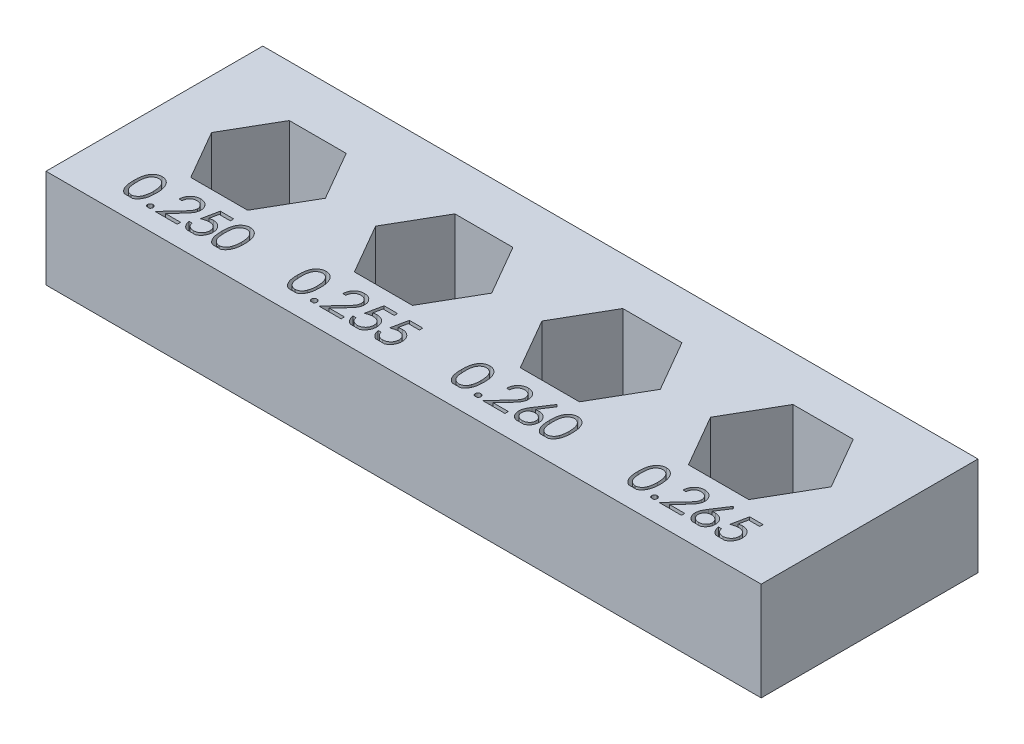
from build123d import *

# Parameters (mm, degrees)
SKETCH1_W           = 46.084275462
SKETCH1_H           = 12.7
BOSS_EXTRUDE2_DEPTH = 6.35
CUT_EXTRUDE1_DEPTH  = 3.175
SKETCH4_W           = 46.084275462
SKETCH4_H           = 1.27
BOSS_EXTRUDE3_DEPTH = 6.35


with BuildPart() as part:
    # Sketch1 → Boss-Extrude2 (new body)
    with BuildSketch(Plane(origin=(0, 0, 0), x_dir=(1, 0, 0), z_dir=(0, 1, 0))):
        with Locations((23.042137731, 6.35)):
            Rectangle(SKETCH1_W, SKETCH1_H)
        Polygon((5.008087105, 9.398), (8.674261314, 9.398), (10.507348419, 6.223), (8.674261314, 3.048), (5.008087105, 3.048), (3.175, 6.223), align=None, mode=Mode.SUBTRACT)
        Polygon((15.552097266, 9.525), (19.291594977, 9.525), (21.161343788, 6.286500031), (19.291594977, 3.048), (15.552097266, 3.048), (13.682348419, 6.286500031), align=None, mode=Mode.SUBTRACT)
        Polygon((26.242754377, 9.652), (30.055575666, 9.652), (31.961986031, 6.350000194), (30.055575666, 3.048), (26.242754377, 3.048), (24.336343788, 6.350000194), align=None, mode=Mode.SUBTRACT)
        Polygon((37.080058362, 9.779), (40.966202917, 9.779), (42.909275462, 6.413499814), (40.966202917, 3.048), (37.080058362, 3.048), (35.136986031, 6.413499814), align=None, mode=Mode.SUBTRACT)
    extrude(amount=BOSS_EXTRUDE2_DEPTH)

    # Sketch3 → Cut-Extrude1 (cut)
    # profile 1 of 20: a face of its own
    with BuildSketch(Plane(origin=(0, 6.35, 0), x_dir=(1, 0, 0), z_dir=(0, 1, 0))):
        with BuildLine():
            add(Edge.make_bspline(
                [(3.337820513, 1.05748531), (3.338018886, 1.091410873), (3.338404228, 1.157311768), (3.342691035, 1.253338671), (3.349812313, 1.343424179), (3.359571582, 1.427572604), (3.371447884, 1.505805672), (3.387302012, 1.57791431), (3.405331659, 1.644232263), (3.426227662, 1.704975788), (3.449805991, 1.760963256), (3.475468616, 1.813229925), (3.504233991, 1.861696713), (3.534458124, 1.907137186), (3.567364473, 1.948807516), (3.602016598, 1.987296173), (3.639766971, 2.021713627), (3.679332314, 2.053068296), (3.721070843, 2.080554405), (3.763792836, 2.10476468), (3.807792352, 2.125447457), (3.85318952, 2.141709768), (3.899576305, 2.155142042), (3.947114864, 2.164327739), (3.995883689, 2.170107393), (4.028801747, 2.170659945), (4.045496127, 2.170940171)],
                knots=[0, 0, 0, 0, 1.646270934, 3.197905019, 4.663502075, 6.030701355, 7.308322542, 8.50163776, 9.611534131, 10.641858119, 11.616356847, 12.558055219, 13.465016945, 14.349605745, 15.204443733, 16.039544428, 16.859896111, 17.680448484, 18.487036065, 19.28249412, 20.06191084, 20.843045899, 21.620316918, 22.403196591, 23.190181807, 24, 24, 24, 24], degree=3))
            add(Edge.make_bspline(
                [(4.045496127, 2.170940171), (4.062329964, 2.170645159), (4.09580717, 2.170058473), (4.145301111, 2.164419708), (4.193651633, 2.155063362), (4.240652602, 2.141806391), (4.286690094, 2.125359482), (4.331404017, 2.104744892), (4.375072109, 2.080748625), (4.417000426, 2.05255228), (4.457649264, 2.02111538), (4.496020175, 1.985577956), (4.532116651, 1.94629884), (4.566391717, 1.903698284), (4.597872959, 1.856959209), (4.627853082, 1.806894533), (4.654687599, 1.752628725), (4.680531903, 1.695067204), (4.702839747, 1.632617277), (4.722957905, 1.565630969), (4.739213281, 1.493317056), (4.75275346, 1.416054946), (4.763242992, 1.333560896), (4.770882733, 1.246011744), (4.774918361, 1.153349888), (4.775678366, 1.089996332), (4.776068376, 1.05748531)],
                knots=[0, 0, 0, 0, 0.810914788, 1.612654377, 2.396697861, 3.181598691, 3.963628158, 4.749916497, 5.551656086, 6.361998678, 7.18212741, 8.025565596, 8.878627764, 9.750805457, 10.657531673, 11.591944965, 12.560506719, 13.57287815, 14.630710178, 15.753379473, 16.941251878, 18.199788006, 19.531962791, 20.947069417, 22.433333509, 24, 24, 24, 24], degree=3))
            add(Edge.make_bspline(
                [(4.776068376, 1.05748531), (4.775674323, 1.025116089), (4.774906525, 0.962045983), (4.770927974, 0.86980106), (4.763091088, 0.782716529), (4.753287904, 0.700583535), (4.739710417, 0.623743928), (4.723015864, 0.551931809), (4.704479717, 0.484837061), (4.681598674, 0.423009341), (4.656555054, 0.365586156), (4.629307388, 0.311963643), (4.600115636, 0.261667837), (4.568311967, 0.215101324), (4.534412998, 0.171934231), (4.497693192, 0.132928526), (4.459187648, 0.097144358), (4.418419187, 0.065302659), (4.375836963, 0.037432325), (4.332318854, 0.012507758), (4.287092713, -0.00759011), (4.241183451, -0.024847015), (4.193934392, -0.038031098), (4.145404432, -0.047147192), (4.095840422, -0.053540643), (4.062335666, -0.054028371), (4.045496127, -0.054273504)],
                knots=[0, 0, 0, 0, 1.561518951, 3.042555995, 4.452378317, 5.7783523, 7.031515105, 8.214008947, 9.334062868, 10.386615937, 11.391082383, 12.354592575, 13.286541444, 14.194233754, 15.072674879, 15.931287219, 16.775624067, 17.606195743, 18.42308326, 19.229000347, 20.022332153, 20.807536673, 21.593273796, 22.3848459, 23.188221202, 24, 24, 24, 24], degree=3))
            add(Edge.make_bspline(
                [(4.045496127, -0.054273504), (4.028802211, -0.05399147), (3.995885066, -0.053435354), (3.947109551, -0.047681812), (3.899767312, -0.038431674), (3.853624732, -0.025479728), (3.808445077, -0.009625994), (3.76484399, 0.011028853), (3.722336676, 0.0348166), (3.681036545, 0.061907164), (3.641719666, 0.092944563), (3.604164796, 0.127273442), (3.569315379, 0.165750458), (3.536879521, 0.207768059), (3.506052335, 0.252939686), (3.477695428, 0.301882083), (3.451466388, 0.354401186), (3.427491515, 0.410836303), (3.406234942, 0.47201095), (3.387458471, 0.538624977), (3.372633242, 0.611266338), (3.35994355, 0.689351603), (3.349708328, 0.773216313), (3.342720713, 0.862905998), (3.338401917, 0.958364767), (3.338017851, 1.023842202), (3.337820513, 1.05748531)],
                knots=[0, 0, 0, 0, 0.810891512, 1.598919785, 2.382837074, 3.152667961, 3.926044502, 4.706494248, 5.493654104, 6.291793342, 7.103789334, 7.925228297, 8.761435821, 9.622817696, 10.50288917, 11.416980706, 12.369136599, 13.353924996, 14.394355917, 15.514179734, 16.714354668, 17.994756427, 19.357759367, 20.818452758, 22.365282078, 24, 24, 24, 24], degree=3))
        make_face()
        with BuildLine():
            add(Edge.make_bspline(
                [(3.527777778, 1.058333333), (3.527850015, 1.030061501), (3.527990213, 0.975191426), (3.531652772, 0.895457645), (3.536642198, 0.821089875), (3.543077649, 0.751993688), (3.552634671, 0.688402966), (3.563343061, 0.629880349), (3.576374525, 0.576735543), (3.591792941, 0.528603867), (3.60935468, 0.484668478), (3.628529179, 0.443785839), (3.649127806, 0.405473001), (3.672180816, 0.370074104), (3.697287545, 0.33747371), (3.723880897, 0.307094806), (3.752953365, 0.280003299), (3.793172295, 0.247511344), (3.846268258, 0.213935486), (3.913167295, 0.184697613), (3.981909644, 0.166323461), (4.028567781, 0.163986808), (4.051856303, 0.162820513)],
                knots=[0, 0, 0, 0, 1.459021318, 2.831673884, 4.118529203, 5.306027144, 6.411944654, 7.436330062, 8.375795394, 9.233974572, 10.042671642, 10.816086306, 11.563610507, 12.285937304, 12.993564865, 13.685989202, 14.367179055, 15.041617293, 16.353048772, 17.594441528, 18.799311195, 20, 20, 20, 20], degree=3))
            add(Edge.make_bspline(
                [(4.051856303, 0.162820513), (4.075295467, 0.16378679), (4.1221254, 0.165717349), (4.19054441, 0.184343252), (4.256965573, 0.212446259), (4.309018604, 0.245676417), (4.348619951, 0.277322597), (4.37699356, 0.304303837), (4.403035846, 0.334515242), (4.427735577, 0.367111483), (4.450389399, 0.402715319), (4.470989487, 0.441155543), (4.489787512, 0.482538903), (4.500497268, 0.511428221), (4.50597289, 0.526198584)],
                knots=[0, 0, 0, 0, 1.353760809, 2.704726607, 4.075137775, 5.516104923, 6.260822281, 7.007110065, 7.778089737, 8.566572457, 9.372053459, 10.217411131, 11.088608312, 12, 12, 12, 12], degree=3))
            add(Edge.make_bspline(
                [(4.50597289, 0.526198584), (4.512354197, 0.545085141), (4.525310987, 0.583432951), (4.542009537, 0.642919541), (4.555160326, 0.705332641), (4.566991504, 0.770299259), (4.575066924, 0.838298507), (4.581566792, 0.909119986), (4.58539535, 0.982817096), (4.585869937, 1.032888352), (4.586111111, 1.058333333)],
                knots=[0, 0, 0, 0, 0.884706709, 1.796334032, 2.740027952, 3.714592787, 4.726048262, 5.777819803, 6.87074269, 8, 8, 8, 8], degree=3))
            add(Edge.make_bspline(
                [(4.586111111, 1.058333333), (4.585778378, 1.083774199), (4.58512748, 1.13354197), (4.582639497, 1.206426774), (4.576214764, 1.275652515), (4.569079106, 1.34151742), (4.558557929, 1.403656889), (4.547213922, 1.462591121), (4.531973189, 1.517589998), (4.515693135, 1.569514602), (4.497060181, 1.617774998), (4.476549237, 1.662596193), (4.454643698, 1.704194574), (4.430851009, 1.74245601), (4.40545362, 1.777551881), (4.377781197, 1.808778517), (4.34893141, 1.837103731), (4.308522921, 1.869435856), (4.255621803, 1.902402453), (4.189796102, 1.932740793), (4.121294332, 1.950162951), (4.074985624, 1.952619305), (4.051856303, 1.953846154)],
                knots=[0, 0, 0, 0, 1.31362396, 2.569729283, 3.763502607, 4.902122613, 5.988968491, 7.01645872, 7.998833611, 8.933434873, 9.825090667, 10.667526885, 11.477055099, 12.250526234, 12.991942729, 13.710640831, 14.402115721, 15.076753259, 16.378508321, 17.609869233, 18.806226677, 20, 20, 20, 20], degree=3))
            add(Edge.make_bspline(
                [(4.051856303, 1.953846154), (4.028445612, 1.952617612), (3.981581581, 1.950158291), (3.912367817, 1.932805704), (3.846022805, 1.902559768), (3.793261577, 1.869326666), (3.752824906, 1.83767445), (3.724351087, 1.810226451), (3.697653164, 1.780202288), (3.673058888, 1.747302082), (3.650023941, 1.711944455), (3.628868757, 1.67385125), (3.609808276, 1.632829425), (3.592219057, 1.588913771), (3.576753609, 1.540786247), (3.563996784, 1.487706904), (3.552211756, 1.429370426), (3.543868903, 1.365435295), (3.536452251, 1.296321803), (3.531685912, 1.221768377), (3.527977961, 1.141900871), (3.527845842, 1.086747094), (3.527777778, 1.058333333)],
                knots=[0, 0, 0, 0, 1.207732386, 2.417664972, 3.655092373, 4.956220595, 5.625982001, 6.301752483, 6.994047911, 7.697131622, 8.419323945, 9.170223765, 9.943494443, 10.752040957, 11.610060368, 12.549350801, 13.567764191, 14.679664412, 15.874934091, 17.154273443, 18.533957287, 20, 20, 20, 20], degree=3))
        make_face(mode=Mode.SUBTRACT)
    # profile 2 of 20: a face of its own
    with BuildSketch(Plane(origin=(0, 6.35, 0), x_dir=(1, 0, 0), z_dir=(0, 1, 0))):
        with BuildLine():
            add(Edge.make_bspline(
                [(5.305235043, 0.325641026), (5.317021981, 0.324940611), (5.340128894, 0.323567529), (5.373535415, 0.31414735), (5.40377028, 0.297420446), (5.430701685, 0.275127242), (5.452900364, 0.248097007), (5.470223377, 0.218103291), (5.479561497, 0.18441709), (5.480924577, 0.161176286), (5.481623932, 0.149252137)],
                knots=[0, 0, 0, 0, 1.020151414, 1.999887582, 2.974338812, 3.990962822, 5.007586832, 5.987933904, 6.967670073, 8, 8, 8, 8], degree=3))
            add(Edge.make_bspline(
                [(5.481623932, 0.149252137), (5.480900878, 0.137614504), (5.479475026, 0.114665263), (5.470244782, 0.08123314), (5.452768343, 0.051220679), (5.430854799, 0.023823672), (5.403763623, 0.001483241), (5.373463935, -0.015101354), (5.340207317, -0.025196027), (5.317035064, -0.026481931), (5.305235043, -0.027136752)],
                knots=[0, 0, 0, 0, 1.009421747, 1.99056486, 2.972319754, 3.999869655, 5.017953583, 5.993804169, 6.978383603, 8, 8, 8, 8], degree=3))
            add(Edge.make_bspline(
                [(5.305235043, -0.027136752), (5.293426519, -0.026505624), (5.270373187, -0.025273498), (5.237240705, -0.014894086), (5.20675649, 0.001327721), (5.179670589, 0.023865328), (5.157573513, 0.0510797), (5.140866734, 0.081439834), (5.130833644, 0.114569561), (5.12951413, 0.137595654), (5.128846154, 0.149252137)],
                knots=[0, 0, 0, 0, 1.022052826, 1.995314843, 2.982371812, 4.00089066, 5.028879526, 6.005146991, 6.990147033, 8, 8, 8, 8], degree=3))
            add(Edge.make_bspline(
                [(5.128846154, 0.149252137), (5.129488471, 0.161195809), (5.130742516, 0.184514364), (5.140887797, 0.217896681), (5.157443887, 0.248236642), (5.17982334, 0.275086002), (5.206749938, 0.297575466), (5.237167167, 0.313943222), (5.270452984, 0.323643853), (5.293439947, 0.324963756), (5.305235043, 0.325641026)],
                knots=[0, 0, 0, 0, 1.032775665, 2.016367738, 2.991239715, 4.008302682, 5.025365648, 6.011011707, 6.979408107, 8, 8, 8, 8], degree=3))
        make_face()
    # profile 3 of 20: a face of its own
    with BuildSketch(Plane(origin=(0, 6.35, 0), x_dir=(1, 0, 0), z_dir=(0, 1, 0))):
        with BuildLine():
            Line((6.024358974, 1.465384615), (5.834401709, 1.465384615))
            add(Edge.make_bspline(
                [(5.834401709, 1.465384615), (5.83563975, 1.490585581), (5.838071227, 1.540079606), (5.84945786, 1.612242159), (5.865750676, 1.681218157), (5.888786936, 1.746453771), (5.917395971, 1.808525812), (5.95170413, 1.867187726), (5.992340411, 1.922215731), (6.038427341, 1.973099698), (6.088482661, 2.0197798), (6.142491491, 2.060090352), (6.199245388, 2.094149134), (6.258572167, 2.122622075), (6.321141175, 2.143994268), (6.386384618, 2.159852117), (6.454589143, 2.16939305), (6.501059061, 2.170418596), (6.524692842, 2.170940171)],
                knots=[0, 0, 0, 0, 1.10065271, 2.161652631, 3.183658789, 4.190468796, 5.17591951, 6.163126047, 7.15150782, 8.156236427, 9.156009102, 10.134482811, 11.092018607, 12.041330605, 13.001268258, 13.972401359, 14.968799086, 16, 16, 16, 16], degree=3))
            add(Edge.make_bspline(
                [(6.524692842, 2.170940171), (6.547902439, 2.170396819), (6.593508468, 2.169329151), (6.660069782, 2.160160338), (6.723435098, 2.145799909), (6.783480557, 2.125652014), (6.839727082, 2.098568099), (6.892597209, 2.066033397), (6.942720366, 2.028405213), (6.987839706, 1.984104097), (7.029270783, 1.936810274), (7.065013575, 1.886319971), (7.095622488, 1.834171783), (7.12113599, 1.779968062), (7.13991756, 1.72319844), (7.154176762, 1.664689417), (7.162236674, 1.603835365), (7.163473668, 1.562647114), (7.164102564, 1.541706731)],
                knots=[0, 0, 0, 0, 1.111607364, 2.184268762, 3.212621178, 4.221274766, 5.211760367, 6.196651075, 7.1921475, 8.207485113, 9.220403448, 10.201281604, 11.166441695, 12.114753415, 13.065576456, 14.026450734, 14.996634279, 16, 16, 16, 16], degree=3))
            add(Edge.make_bspline(
                [(7.164102564, 1.541706731), (7.163078543, 1.512225897), (7.161048472, 1.453781578), (7.143683111, 1.367896399), (7.116561649, 1.284685141), (7.083906105, 1.217715439), (7.050963246, 1.163750421), (7.021276991, 1.119319347), (6.986524462, 1.071479374), (6.946199847, 1.020390698), (6.901137301, 0.965653151), (6.850928659, 0.907299798), (6.795215886, 0.845933538), (6.756112888, 0.80402015), (6.735850694, 0.782301683)],
                knots=[0, 0, 0, 0, 1.184426356, 2.348067706, 3.509069118, 4.696110526, 5.333549288, 6.050745305, 6.844228056, 7.710549037, 8.667450064, 9.695053472, 10.805634456, 12, 12, 12, 12], degree=3))
            Line((6.735850694, 0.782301683), (6.206260016, 0.217094017))
            Line((6.206260016, 0.217094017), (7.191239316, 0.217094017))
            Line((7.191239316, 0.217094017), (7.191239316, 0))
            Line((7.191239316, 0), (5.752991453, 0))
            Line((5.752991453, 0), (6.573878205, 0.87600828))
            add(Edge.make_bspline(
                [(6.573878205, 0.87600828), (6.593864308, 0.896871541), (6.632253522, 0.936945597), (6.686550604, 0.995452054), (6.735317992, 1.049729157), (6.778871368, 1.099674356), (6.816265916, 1.146018209), (6.849450552, 1.187259767), (6.876039266, 1.225211268), (6.90489572, 1.26920202), (6.932844175, 1.322912327), (6.956860695, 1.388549367), (6.971504913, 1.456117753), (6.973261647, 1.501778509), (6.974145299, 1.524746261)],
                knots=[0, 0, 0, 0, 1.329631726, 2.553950428, 3.673215718, 4.687767853, 5.603093632, 6.413772471, 7.123043292, 7.734684054, 8.834405432, 9.900288307, 10.943827018, 12, 12, 12, 12], degree=3))
            add(Edge.make_bspline(
                [(6.974145299, 1.524746261), (6.973760826, 1.539188821), (6.973003105, 1.567652333), (6.96631583, 1.609384387), (6.956209953, 1.649640251), (6.941728773, 1.688543749), (6.922614221, 1.725703739), (6.899346986, 1.761165453), (6.872501567, 1.795448779), (6.841446275, 1.827593869), (6.807330737, 1.857034408), (6.771290405, 1.883114212), (6.733160104, 1.904909293), (6.693100602, 1.922776075), (6.65122358, 1.936791662), (6.607448043, 1.94650328), (6.561894948, 1.952600782), (6.530789929, 1.953425781), (6.514940572, 1.953846154)],
                knots=[0, 0, 0, 0, 0.991446411, 1.95395049, 2.89581595, 3.838931463, 4.798493298, 5.75982156, 6.748411868, 7.785213223, 8.824556874, 9.840280684, 10.836137867, 11.835679398, 12.848801643, 13.863922112, 14.911575587, 16, 16, 16, 16], degree=3))
            add(Edge.make_bspline(
                [(6.514940572, 1.953846154), (6.498387735, 1.95341373), (6.465880696, 1.95256452), (6.418153471, 1.946624147), (6.372623501, 1.936375948), (6.329176255, 1.922359578), (6.28773822, 1.90454417), (6.248510917, 1.882354401), (6.211582408, 1.855875812), (6.176883272, 1.825855095), (6.144913152, 1.792431355), (6.11682385, 1.755171996), (6.092280185, 1.714757321), (6.070866029, 1.671296379), (6.053475683, 1.624394807), (6.040187159, 1.5742191), (6.029672256, 1.520987122), (6.026159484, 1.484226618), (6.024358974, 1.465384615)],
                knots=[0, 0, 0, 0, 1.031018746, 2.02475058, 2.990194455, 3.934040569, 4.864654155, 5.795059489, 6.735614925, 7.690564532, 8.649604399, 9.611025574, 10.590972636, 11.591080095, 12.624614302, 13.701020113, 14.821632451, 16, 16, 16, 16], degree=3))
        make_face()
    # profile 4 of 20: a face of its own
    with BuildSketch(Plane(origin=(0, 6.35, 0), x_dir=(1, 0, 0), z_dir=(0, 1, 0))):
        with BuildLine():
            Line((8.710897436, 2.116666667), (8.710897436, 1.89957265))
            Line((8.710897436, 1.89957265), (7.990925481, 1.89957265))
            Line((7.990925481, 1.89957265), (7.876866319, 1.342845219))
            add(Edge.make_bspline(
                [(7.876866319, 1.342845219), (7.899276301, 1.349032098), (7.942692095, 1.361018197), (8.006772582, 1.374326448), (8.067606915, 1.382348883), (8.107082972, 1.383444295), (8.12618523, 1.383974359)],
                knots=[0, 0, 0, 0, 1.100273476, 2.13160584, 3.095893838, 4, 4, 4, 4], degree=3))
            add(Edge.make_bspline(
                [(8.12618523, 1.383974359), (8.149821587, 1.383462769), (8.19629657, 1.382456856), (8.264295361, 1.37279769), (8.329206206, 1.357594027), (8.390893354, 1.336354474), (8.449470925, 1.309194778), (8.504399974, 1.275267671), (8.556504998, 1.235635609), (8.604851233, 1.190069816), (8.648711172, 1.139921981), (8.687274413, 1.086002697), (8.720029885, 1.028835968), (8.74637377, 0.9678756), (8.76741001, 0.903795541), (8.781411454, 0.83592155), (8.790734893, 0.764893402), (8.791776526, 0.716328257), (8.792307692, 0.691563168)],
                knots=[0, 0, 0, 0, 1.052922333, 2.070308379, 3.05430497, 4.020497103, 4.973039431, 5.925935799, 6.892292201, 7.88610001, 8.88166317, 9.857072816, 10.836096531, 11.812156883, 12.81219415, 13.836441305, 14.89672472, 16, 16, 16, 16], degree=3))
            add(Edge.make_bspline(
                [(8.792307692, 0.691563168), (8.79190548, 0.674314015), (8.791106491, 0.640048818), (8.787043345, 0.589161611), (8.779220317, 0.539351707), (8.768716979, 0.490612499), (8.755084184, 0.44303626), (8.738580803, 0.396486812), (8.718384158, 0.351253883), (8.696230898, 0.306909477), (8.671286599, 0.264456094), (8.643601502, 0.224754088), (8.614351895, 0.18720788), (8.582879248, 0.152220146), (8.548891027, 0.120020797), (8.512798857, 0.090418741), (8.474890736, 0.062913365), (8.434580185, 0.038621171), (8.392765445, 0.016267383), (8.348842666, -0.002071137), (8.303811671, -0.018466552), (8.257024342, -0.031535171), (8.208586655, -0.041775335), (8.158418767, -0.04873046), (8.10678379, -0.05379621), (8.071783187, -0.054113321), (8.054103232, -0.054273504)],
                knots=[0, 0, 0, 0, 1.056347294, 2.098418968, 3.122841568, 4.141288669, 5.149314143, 6.15115421, 7.162517403, 8.180376062, 9.185164535, 10.17417709, 11.141909838, 12.097768115, 13.052685741, 14.0056014, 14.954263652, 15.917497458, 16.885230207, 17.854509472, 18.828990115, 19.81800267, 20.826176721, 21.857883937, 22.917946725, 24, 24, 24, 24], degree=3))
            add(Edge.make_bspline(
                [(8.054103232, -0.054273504), (8.033012656, -0.053855712), (7.991519439, -0.053033754), (7.93072843, -0.044434956), (7.87223912, -0.032119635), (7.816522345, -0.013591986), (7.763078771, 0.009623187), (7.71262789, 0.038963919), (7.663880587, 0.072213187), (7.618818546, 0.111450353), (7.576995563, 0.154337456), (7.539556864, 0.200878505), (7.506214178, 0.250305358), (7.477501445, 0.302858052), (7.453009784, 0.358398496), (7.433769291, 0.417134787), (7.418240001, 0.478760028), (7.411670218, 0.521186199), (7.408333333, 0.542735043)],
                knots=[0, 0, 0, 0, 1.0467383, 2.05933395, 3.04377827, 4.011590433, 4.970194871, 5.932262533, 6.905835911, 7.896367577, 8.894135286, 9.877477877, 10.858688626, 11.851381753, 12.8477658, 13.868841284, 14.917554742, 16, 16, 16, 16], degree=3))
            Line((7.408333333, 0.542735043), (7.598290598, 0.542735043))
            add(Edge.make_bspline(
                [(7.598290598, 0.542735043), (7.602964535, 0.522550236), (7.611948102, 0.483753916), (7.631666817, 0.429245914), (7.655776179, 0.380671908), (7.684444524, 0.33738935), (7.718643828, 0.299646766), (7.757668768, 0.266011686), (7.801421915, 0.235667679), (7.850040678, 0.210374863), (7.901332397, 0.188803759), (7.955015424, 0.174439639), (8.009628053, 0.164339575), (8.046565924, 0.163328558), (8.065127537, 0.162820513)],
                knots=[0, 0, 0, 0, 1.136247022, 2.183929868, 3.172523383, 4.106158343, 5.02341133, 5.958108904, 6.928429099, 7.938127109, 8.96079061, 9.975095812, 10.982467395, 12, 12, 12, 12], degree=3))
            add(Edge.make_bspline(
                [(8.065127537, 0.162820513), (8.083245263, 0.163316888), (8.118919214, 0.164294255), (8.171419433, 0.171816896), (8.222106267, 0.183402665), (8.270479573, 0.200741101), (8.317385838, 0.221813859), (8.361638546, 0.248855834), (8.404517905, 0.279976892), (8.44469111, 0.315631616), (8.481484491, 0.354922813), (8.513994145, 0.396940093), (8.541073517, 0.441763139), (8.563893668, 0.48861595), (8.581222092, 0.53801203), (8.593584019, 0.589719884), (8.600843011, 0.643867229), (8.601841582, 0.680799621), (8.602350427, 0.699619391)],
                knots=[0, 0, 0, 0, 1.027316725, 2.022795036, 3.002884548, 3.971462791, 4.93288096, 5.914575861, 6.907176829, 7.935150275, 8.956128384, 9.956726525, 10.942570165, 11.921478529, 12.907843606, 13.90538589, 14.932640048, 16, 16, 16, 16], degree=3))
            add(Edge.make_bspline(
                [(8.602350427, 0.699619391), (8.601952204, 0.716598536), (8.601172739, 0.749832797), (8.594804251, 0.798455174), (8.583726844, 0.844461252), (8.56835145, 0.888073193), (8.548830033, 0.929332132), (8.524974406, 0.96828065), (8.496336875, 1.004405396), (8.463624161, 1.037723274), (8.427787156, 1.068472317), (8.388209273, 1.09468517), (8.345718746, 1.116737158), (8.300827512, 1.135767805), (8.252467788, 1.149435874), (8.201597253, 1.159697405), (8.147666577, 1.165633363), (8.110793828, 1.166456981), (8.091840278, 1.166880342)],
                knots=[0, 0, 0, 0, 1.045622112, 2.046656509, 3.013763289, 3.955457236, 4.890082067, 5.820317437, 6.762574623, 7.722996705, 8.69280354, 9.665887285, 10.63943826, 11.638615906, 12.663482002, 13.728887084, 14.832589034, 16, 16, 16, 16], degree=3))
            add(Edge.make_bspline(
                [(8.091840278, 1.166880342), (8.075433735, 1.166529222), (8.041558387, 1.16580425), (7.989595535, 1.160466321), (7.93499054, 1.151854938), (7.877952726, 1.140009922), (7.8183108, 1.124509223), (7.756190624, 1.105934263), (7.691461587, 1.083726197), (7.647847534, 1.066954811), (7.62542735, 1.058333333)],
                knots=[0, 0, 0, 0, 0.817624296, 1.688186739, 2.600797293, 3.572016777, 4.590301741, 5.671205678, 6.80286297, 8, 8, 8, 8], degree=3))
            Line((7.62542735, 1.058333333), (7.842521368, 2.116666667))
            Line((7.842521368, 2.116666667), (8.710897436, 2.116666667))
        make_face()
    # profile 5 of 20: a face of its own
    with BuildSketch(Plane(origin=(0, 6.35, 0), x_dir=(1, 0, 0), z_dir=(0, 1, 0))):
        with BuildLine():
            add(Edge.make_bspline(
                [(9.009401709, 1.05748531), (9.009600082, 1.091410873), (9.009985424, 1.157311768), (9.014272231, 1.253338671), (9.02139351, 1.343424179), (9.031152778, 1.427572604), (9.043029081, 1.505805672), (9.058883208, 1.57791431), (9.076912855, 1.644232263), (9.097808858, 1.704975788), (9.121387188, 1.760963256), (9.147049812, 1.813229925), (9.175815188, 1.861696713), (9.206039321, 1.907137186), (9.238945669, 1.948807516), (9.273597795, 1.987296173), (9.311348168, 2.021713627), (9.350913511, 2.053068296), (9.392652039, 2.080554405), (9.435374032, 2.10476468), (9.479373549, 2.125447457), (9.524770717, 2.141709768), (9.571157502, 2.155142042), (9.618696061, 2.164327739), (9.667464886, 2.170107393), (9.700382944, 2.170659945), (9.717077324, 2.170940171)],
                knots=[0, 0, 0, 0, 1.646270934, 3.197905019, 4.663502075, 6.030701355, 7.308322542, 8.50163776, 9.611534131, 10.641858119, 11.616356847, 12.558055219, 13.465016945, 14.349605745, 15.204443733, 16.039544428, 16.859896111, 17.680448484, 18.487036065, 19.28249412, 20.06191084, 20.843045899, 21.620316918, 22.403196591, 23.190181807, 24, 24, 24, 24], degree=3))
            add(Edge.make_bspline(
                [(9.717077324, 2.170940171), (9.733911161, 2.170645159), (9.767388366, 2.170058473), (9.816882307, 2.164419708), (9.865232829, 2.155063362), (9.912233799, 2.141806391), (9.958271291, 2.125359482), (10.002985213, 2.104744892), (10.046653305, 2.080748625), (10.088581622, 2.05255228), (10.129230461, 2.02111538), (10.167601372, 1.985577956), (10.203697848, 1.94629884), (10.237972913, 1.903698284), (10.269454155, 1.856959209), (10.299434279, 1.806894533), (10.326268796, 1.752628725), (10.352113099, 1.695067204), (10.374420944, 1.632617277), (10.394539101, 1.565630969), (10.410794478, 1.493317056), (10.424334657, 1.416054946), (10.434824189, 1.333560896), (10.44246393, 1.246011744), (10.446499557, 1.153349888), (10.447259562, 1.089996332), (10.447649573, 1.05748531)],
                knots=[0, 0, 0, 0, 0.810914788, 1.612654377, 2.396697861, 3.181598691, 3.963628158, 4.749916497, 5.551656086, 6.361998678, 7.18212741, 8.025565596, 8.878627764, 9.750805457, 10.657531673, 11.591944965, 12.560506719, 13.57287815, 14.630710178, 15.753379473, 16.941251878, 18.199788006, 19.531962791, 20.947069417, 22.433333509, 24, 24, 24, 24], degree=3))
            add(Edge.make_bspline(
                [(10.447649573, 1.05748531), (10.447255519, 1.025116089), (10.446487722, 0.962045983), (10.442509171, 0.86980106), (10.434672284, 0.782716529), (10.424869101, 0.700583535), (10.411291614, 0.623743928), (10.394597061, 0.551931809), (10.376060913, 0.484837061), (10.353179871, 0.423009341), (10.328136251, 0.365586156), (10.300888585, 0.311963643), (10.271696833, 0.261667837), (10.239893163, 0.215101324), (10.205994194, 0.171934231), (10.169274389, 0.132928526), (10.130768844, 0.097144358), (10.090000383, 0.065302659), (10.047418159, 0.037432325), (10.003900051, 0.012507758), (9.95867391, -0.00759011), (9.912764648, -0.024847015), (9.865515588, -0.038031098), (9.816985628, -0.047147192), (9.767421619, -0.053540643), (9.733916863, -0.054028371), (9.717077324, -0.054273504)],
                knots=[0, 0, 0, 0, 1.561518951, 3.042555995, 4.452378317, 5.7783523, 7.031515105, 8.214008947, 9.334062868, 10.386615937, 11.391082383, 12.354592575, 13.286541444, 14.194233754, 15.072674879, 15.931287219, 16.775624067, 17.606195743, 18.42308326, 19.229000347, 20.022332153, 20.807536673, 21.593273796, 22.3848459, 23.188221202, 24, 24, 24, 24], degree=3))
            add(Edge.make_bspline(
                [(9.717077324, -0.054273504), (9.700383407, -0.05399147), (9.667466262, -0.053435354), (9.618690748, -0.047681812), (9.571348508, -0.038431674), (9.525205928, -0.025479728), (9.480026274, -0.009625994), (9.436425186, 0.011028853), (9.393917873, 0.0348166), (9.352617741, 0.061907164), (9.313300863, 0.092944563), (9.275745992, 0.127273442), (9.240896576, 0.165750458), (9.208460718, 0.207768059), (9.177633531, 0.252939686), (9.149276625, 0.301882083), (9.123047584, 0.354401186), (9.099072711, 0.410836303), (9.077816139, 0.47201095), (9.059039668, 0.538624977), (9.044214439, 0.611266338), (9.031524747, 0.689351603), (9.021289525, 0.773216313), (9.014301909, 0.862905998), (9.009983114, 0.958364767), (9.009599047, 1.023842202), (9.009401709, 1.05748531)],
                knots=[0, 0, 0, 0, 0.810891512, 1.598919785, 2.382837074, 3.152667961, 3.926044502, 4.706494248, 5.493654104, 6.291793342, 7.103789334, 7.925228297, 8.761435821, 9.622817696, 10.50288917, 11.416980706, 12.369136599, 13.353924996, 14.394355917, 15.514179734, 16.714354668, 17.994756427, 19.357759367, 20.818452758, 22.365282078, 24, 24, 24, 24], degree=3))
        make_face()
        with BuildLine():
            add(Edge.make_bspline(
                [(9.199358974, 1.058333333), (9.199431211, 1.030061501), (9.199571409, 0.975191426), (9.203233969, 0.895457645), (9.208223395, 0.821089875), (9.214658846, 0.751993688), (9.224215867, 0.688402966), (9.234924258, 0.629880349), (9.247955722, 0.576735543), (9.263374137, 0.528603867), (9.280935877, 0.484668478), (9.300110375, 0.443785839), (9.320709003, 0.405473001), (9.343762013, 0.370074104), (9.368868742, 0.33747371), (9.395462094, 0.307094806), (9.424534561, 0.280003299), (9.464753491, 0.247511344), (9.517849454, 0.213935486), (9.584748492, 0.184697613), (9.65349084, 0.166323461), (9.700148977, 0.163986808), (9.7234375, 0.162820513)],
                knots=[0, 0, 0, 0, 1.459021318, 2.831673884, 4.118529203, 5.306027144, 6.411944654, 7.436330062, 8.375795394, 9.233974572, 10.042671642, 10.816086306, 11.563610507, 12.285937304, 12.993564865, 13.685989202, 14.367179055, 15.041617293, 16.353048772, 17.594441528, 18.799311195, 20, 20, 20, 20], degree=3))
            add(Edge.make_bspline(
                [(9.7234375, 0.162820513), (9.746876663, 0.16378679), (9.793706597, 0.165717349), (9.862125606, 0.184343252), (9.92854677, 0.212446259), (9.9805998, 0.245676417), (10.020201148, 0.277322597), (10.048574756, 0.304303837), (10.074617043, 0.334515242), (10.099316774, 0.367111483), (10.121970596, 0.402715319), (10.142570684, 0.441155543), (10.161368708, 0.482538903), (10.172078464, 0.511428221), (10.177554087, 0.526198584)],
                knots=[0, 0, 0, 0, 1.353760809, 2.704726607, 4.075137775, 5.516104923, 6.260822281, 7.007110065, 7.778089737, 8.566572457, 9.372053459, 10.217411131, 11.088608312, 12, 12, 12, 12], degree=3))
            add(Edge.make_bspline(
                [(10.177554087, 0.526198584), (10.183935394, 0.545085141), (10.196892184, 0.583432951), (10.213590733, 0.642919541), (10.226741522, 0.705332641), (10.238572701, 0.770299259), (10.24664812, 0.838298507), (10.253147988, 0.909119986), (10.256976546, 0.982817096), (10.257451134, 1.032888352), (10.257692308, 1.058333333)],
                knots=[0, 0, 0, 0, 0.884706709, 1.796334032, 2.740027952, 3.714592787, 4.726048262, 5.777819803, 6.87074269, 8, 8, 8, 8], degree=3))
            add(Edge.make_bspline(
                [(10.257692308, 1.058333333), (10.257359574, 1.083774199), (10.256708676, 1.13354197), (10.254220693, 1.206426774), (10.24779596, 1.275652515), (10.240660303, 1.34151742), (10.230139126, 1.403656889), (10.218795119, 1.462591121), (10.203554386, 1.517589998), (10.187274331, 1.569514602), (10.168641378, 1.617774998), (10.148130434, 1.662596193), (10.126224894, 1.704194574), (10.102432206, 1.74245601), (10.077034817, 1.777551881), (10.049362394, 1.808778517), (10.020512607, 1.837103731), (9.980104118, 1.869435856), (9.927203, 1.902402453), (9.861377299, 1.932740793), (9.792875528, 1.950162951), (9.74656682, 1.952619305), (9.7234375, 1.953846154)],
                knots=[0, 0, 0, 0, 1.31362396, 2.569729283, 3.763502607, 4.902122613, 5.988968491, 7.01645872, 7.998833611, 8.933434873, 9.825090667, 10.667526885, 11.477055099, 12.250526234, 12.991942729, 13.710640831, 14.402115721, 15.076753259, 16.378508321, 17.609869233, 18.806226677, 20, 20, 20, 20], degree=3))
            add(Edge.make_bspline(
                [(9.7234375, 1.953846154), (9.700026809, 1.952617612), (9.653162777, 1.950158291), (9.583949014, 1.932805704), (9.517604001, 1.902559768), (9.464842774, 1.869326666), (9.424406103, 1.83767445), (9.395932284, 1.810226451), (9.36923436, 1.780202288), (9.344640085, 1.747302082), (9.321605137, 1.711944455), (9.300449953, 1.67385125), (9.281389473, 1.632829425), (9.263800254, 1.588913771), (9.248334806, 1.540786247), (9.23557798, 1.487706904), (9.223792953, 1.429370426), (9.2154501, 1.365435295), (9.208033447, 1.296321803), (9.203267108, 1.221768377), (9.199559157, 1.141900871), (9.199427039, 1.086747094), (9.199358974, 1.058333333)],
                knots=[0, 0, 0, 0, 1.207732386, 2.417664972, 3.655092373, 4.956220595, 5.625982001, 6.301752483, 6.994047911, 7.697131622, 8.419323945, 9.170223765, 9.943494443, 10.752040957, 11.610060368, 12.549350801, 13.567764191, 14.679664412, 15.874934091, 17.154273443, 18.533957287, 20, 20, 20, 20], degree=3))
        make_face(mode=Mode.SUBTRACT)
    # profile 6 of 20: a face of its own
    with BuildSketch(Plane(origin=(0, 6.35, 0), x_dir=(1, 0, 0), z_dir=(0, 1, 0))):
        with BuildLine():
            add(Edge.make_bspline(
                [(13.894017094, 1.05748531), (13.894215467, 1.091410873), (13.894600809, 1.157311768), (13.898887616, 1.253338671), (13.906008894, 1.343424179), (13.915768163, 1.427572604), (13.927644465, 1.505805672), (13.943498593, 1.57791431), (13.96152824, 1.644232263), (13.982424243, 1.704975788), (14.006002573, 1.760963256), (14.031665197, 1.813229925), (14.060430573, 1.861696713), (14.090654706, 1.907137186), (14.123561054, 1.948807516), (14.158213179, 1.987296173), (14.195963552, 2.021713627), (14.235528895, 2.053068296), (14.277267424, 2.080554405), (14.319989417, 2.10476468), (14.363988933, 2.125447457), (14.409386101, 2.141709768), (14.455772886, 2.155142042), (14.503311446, 2.164327739), (14.55208027, 2.170107393), (14.584998329, 2.170659945), (14.601692708, 2.170940171)],
                knots=[0, 0, 0, 0, 1.646270934, 3.197905019, 4.663502075, 6.030701355, 7.308322542, 8.50163776, 9.611534131, 10.641858119, 11.616356847, 12.558055219, 13.465016945, 14.349605745, 15.204443733, 16.039544428, 16.859896111, 17.680448484, 18.487036065, 19.28249412, 20.06191084, 20.843045899, 21.620316918, 22.403196591, 23.190181807, 24, 24, 24, 24], degree=3))
            add(Edge.make_bspline(
                [(14.601692708, 2.170940171), (14.618526545, 2.170645159), (14.652003751, 2.170058473), (14.701497692, 2.164419708), (14.749848214, 2.155063362), (14.796849183, 2.141806391), (14.842886675, 2.125359482), (14.887600598, 2.104744892), (14.93126869, 2.080748625), (14.973197007, 2.05255228), (15.013845846, 2.02111538), (15.052216757, 1.985577956), (15.088313232, 1.94629884), (15.122588298, 1.903698284), (15.15406954, 1.856959209), (15.184049663, 1.806894533), (15.21088418, 1.752628725), (15.236728484, 1.695067204), (15.259036328, 1.632617277), (15.279154486, 1.565630969), (15.295409862, 1.493317056), (15.308950041, 1.416054946), (15.319439574, 1.333560896), (15.327079314, 1.246011744), (15.331114942, 1.153349888), (15.331874947, 1.089996332), (15.332264957, 1.05748531)],
                knots=[0, 0, 0, 0, 0.810914788, 1.612654377, 2.396697861, 3.181598691, 3.963628158, 4.749916497, 5.551656086, 6.361998678, 7.18212741, 8.025565596, 8.878627764, 9.750805457, 10.657531673, 11.591944965, 12.560506719, 13.57287815, 14.630710178, 15.753379473, 16.941251878, 18.199788006, 19.531962791, 20.947069417, 22.433333509, 24, 24, 24, 24], degree=3))
            add(Edge.make_bspline(
                [(15.332264957, 1.05748531), (15.331870904, 1.025116089), (15.331103107, 0.962045983), (15.327124555, 0.86980106), (15.319287669, 0.782716529), (15.309484485, 0.700583535), (15.295906998, 0.623743928), (15.279212445, 0.551931809), (15.260676298, 0.484837061), (15.237795256, 0.423009341), (15.212751636, 0.365586156), (15.185503969, 0.311963643), (15.156312217, 0.261667837), (15.124508548, 0.215101324), (15.090609579, 0.171934231), (15.053889773, 0.132928526), (15.015384229, 0.097144358), (14.974615768, 0.065302659), (14.932033544, 0.037432325), (14.888515436, 0.012507758), (14.843289294, -0.00759011), (14.797380032, -0.024847015), (14.750130973, -0.038031098), (14.701601013, -0.047147192), (14.652037003, -0.053540643), (14.618532247, -0.054028371), (14.601692708, -0.054273504)],
                knots=[0, 0, 0, 0, 1.561518951, 3.042555995, 4.452378317, 5.7783523, 7.031515105, 8.214008947, 9.334062868, 10.386615937, 11.391082383, 12.354592575, 13.286541444, 14.194233754, 15.072674879, 15.931287219, 16.775624067, 17.606195743, 18.42308326, 19.229000347, 20.022332153, 20.807536673, 21.593273796, 22.3848459, 23.188221202, 24, 24, 24, 24], degree=3))
            add(Edge.make_bspline(
                [(14.601692708, -0.054273504), (14.584998792, -0.05399147), (14.552081647, -0.053435354), (14.503306132, -0.047681812), (14.455963893, -0.038431674), (14.409821313, -0.025479728), (14.364641659, -0.009625994), (14.321040571, 0.011028853), (14.278533257, 0.0348166), (14.237233126, 0.061907164), (14.197916248, 0.092944563), (14.160361377, 0.127273442), (14.12551196, 0.165750458), (14.093076103, 0.207768059), (14.062248916, 0.252939686), (14.033892009, 0.301882083), (14.007662969, 0.354401186), (13.983688096, 0.410836303), (13.962431523, 0.47201095), (13.943655052, 0.538624977), (13.928829824, 0.611266338), (13.916140132, 0.689351603), (13.90590491, 0.773216313), (13.898917294, 0.862905998), (13.894598498, 0.958364767), (13.894214432, 1.023842202), (13.894017094, 1.05748531)],
                knots=[0, 0, 0, 0, 0.810891512, 1.598919785, 2.382837074, 3.152667961, 3.926044502, 4.706494248, 5.493654104, 6.291793342, 7.103789334, 7.925228297, 8.761435821, 9.622817696, 10.50288917, 11.416980706, 12.369136599, 13.353924996, 14.394355917, 15.514179734, 16.714354668, 17.994756427, 19.357759367, 20.818452758, 22.365282078, 24, 24, 24, 24], degree=3))
        make_face()
        with BuildLine():
            add(Edge.make_bspline(
                [(14.083974359, 1.058333333), (14.084046596, 1.030061501), (14.084186794, 0.975191426), (14.087849353, 0.895457645), (14.092838779, 0.821089875), (14.09927423, 0.751993688), (14.108831252, 0.688402966), (14.119539642, 0.629880349), (14.132571106, 0.576735543), (14.147989522, 0.528603867), (14.165551261, 0.484668478), (14.18472576, 0.443785839), (14.205324387, 0.405473001), (14.228377398, 0.370074104), (14.253484126, 0.33747371), (14.280077478, 0.307094806), (14.309149946, 0.280003299), (14.349368876, 0.247511344), (14.402464839, 0.213935486), (14.469363876, 0.184697613), (14.538106225, 0.166323461), (14.584764362, 0.163986808), (14.608052885, 0.162820513)],
                knots=[0, 0, 0, 0, 1.459021318, 2.831673884, 4.118529203, 5.306027144, 6.411944654, 7.436330062, 8.375795394, 9.233974572, 10.042671642, 10.816086306, 11.563610507, 12.285937304, 12.993564865, 13.685989202, 14.367179055, 15.041617293, 16.353048772, 17.594441528, 18.799311195, 20, 20, 20, 20], degree=3))
            add(Edge.make_bspline(
                [(14.608052885, 0.162820513), (14.631492048, 0.16378679), (14.678321981, 0.165717349), (14.746740991, 0.184343252), (14.813162154, 0.212446259), (14.865215185, 0.245676417), (14.904816533, 0.277322597), (14.933190141, 0.304303837), (14.959232427, 0.334515242), (14.983932158, 0.367111483), (15.00658598, 0.402715319), (15.027186068, 0.441155543), (15.045984093, 0.482538903), (15.056693849, 0.511428221), (15.062169471, 0.526198584)],
                knots=[0, 0, 0, 0, 1.353760809, 2.704726607, 4.075137775, 5.516104923, 6.260822281, 7.007110065, 7.778089737, 8.566572457, 9.372053459, 10.217411131, 11.088608312, 12, 12, 12, 12], degree=3))
            add(Edge.make_bspline(
                [(15.062169471, 0.526198584), (15.068550778, 0.545085141), (15.081507569, 0.583432951), (15.098206118, 0.642919541), (15.111356907, 0.705332641), (15.123188085, 0.770299259), (15.131263505, 0.838298507), (15.137763373, 0.909119986), (15.141591931, 0.982817096), (15.142066519, 1.032888352), (15.142307692, 1.058333333)],
                knots=[0, 0, 0, 0, 0.884706709, 1.796334032, 2.740027952, 3.714592787, 4.726048262, 5.777819803, 6.87074269, 8, 8, 8, 8], degree=3))
            add(Edge.make_bspline(
                [(15.142307692, 1.058333333), (15.141974959, 1.083774199), (15.141324061, 1.13354197), (15.138836078, 1.206426774), (15.132411345, 1.275652515), (15.125275687, 1.34151742), (15.114754511, 1.403656889), (15.103410504, 1.462591121), (15.08816977, 1.517589998), (15.071889716, 1.569514602), (15.053256763, 1.617774998), (15.032745819, 1.662596193), (15.010840279, 1.704194574), (14.98704759, 1.74245601), (14.961650201, 1.777551881), (14.933977779, 1.808778517), (14.905127991, 1.837103731), (14.864719503, 1.869435856), (14.811818384, 1.902402453), (14.745992683, 1.932740793), (14.677490913, 1.950162951), (14.631182205, 1.952619305), (14.608052885, 1.953846154)],
                knots=[0, 0, 0, 0, 1.31362396, 2.569729283, 3.763502607, 4.902122613, 5.988968491, 7.01645872, 7.998833611, 8.933434873, 9.825090667, 10.667526885, 11.477055099, 12.250526234, 12.991942729, 13.710640831, 14.402115721, 15.076753259, 16.378508321, 17.609869233, 18.806226677, 20, 20, 20, 20], degree=3))
            add(Edge.make_bspline(
                [(14.608052885, 1.953846154), (14.584642193, 1.952617612), (14.537778162, 1.950158291), (14.468564399, 1.932805704), (14.402219386, 1.902559768), (14.349458158, 1.869326666), (14.309021488, 1.83767445), (14.280547668, 1.810226451), (14.253849745, 1.780202288), (14.229255469, 1.747302082), (14.206220522, 1.711944455), (14.185065338, 1.67385125), (14.166004858, 1.632829425), (14.148415638, 1.588913771), (14.13295019, 1.540786247), (14.120193365, 1.487706904), (14.108408337, 1.429370426), (14.100065484, 1.365435295), (14.092648832, 1.296321803), (14.087882493, 1.221768377), (14.084174542, 1.141900871), (14.084042423, 1.086747094), (14.083974359, 1.058333333)],
                knots=[0, 0, 0, 0, 1.207732386, 2.417664972, 3.655092373, 4.956220595, 5.625982001, 6.301752483, 6.994047911, 7.697131622, 8.419323945, 9.170223765, 9.943494443, 10.752040957, 11.610060368, 12.549350801, 13.567764191, 14.679664412, 15.874934091, 17.154273443, 18.533957287, 20, 20, 20, 20], degree=3))
        make_face(mode=Mode.SUBTRACT)
    # profile 7 of 20: a face of its own
    with BuildSketch(Plane(origin=(0, 6.35, 0), x_dir=(1, 0, 0), z_dir=(0, 1, 0))):
        with BuildLine():
            add(Edge.make_bspline(
                [(15.861431624, 0.325641026), (15.873218562, 0.324940611), (15.896325475, 0.323567529), (15.929731996, 0.31414735), (15.959966862, 0.297420446), (15.986898267, 0.275127242), (16.009096945, 0.248097007), (16.026419958, 0.218103291), (16.035758078, 0.18441709), (16.037121158, 0.161176286), (16.037820513, 0.149252137)],
                knots=[0, 0, 0, 0, 1.020151414, 1.999887582, 2.974338812, 3.990962822, 5.007586832, 5.987933904, 6.967670073, 8, 8, 8, 8], degree=3))
            add(Edge.make_bspline(
                [(16.037820513, 0.149252137), (16.037097459, 0.137614504), (16.035671608, 0.114665263), (16.026441364, 0.08123314), (16.008964924, 0.051220679), (15.98705138, 0.023823672), (15.959960204, 0.001483241), (15.929660516, -0.015101354), (15.896403898, -0.025196027), (15.873231645, -0.026481931), (15.861431624, -0.027136752)],
                knots=[0, 0, 0, 0, 1.009421747, 1.99056486, 2.972319754, 3.999869655, 5.017953583, 5.993804169, 6.978383603, 8, 8, 8, 8], degree=3))
            add(Edge.make_bspline(
                [(15.861431624, -0.027136752), (15.8496231, -0.026505624), (15.826569768, -0.025273498), (15.793437286, -0.014894086), (15.762953072, 0.001327721), (15.73586717, 0.023865328), (15.713770094, 0.0510797), (15.697063315, 0.081439834), (15.687030225, 0.114569561), (15.685710711, 0.137595654), (15.685042735, 0.149252137)],
                knots=[0, 0, 0, 0, 1.022052826, 1.995314843, 2.982371812, 4.00089066, 5.028879526, 6.005146991, 6.990147033, 8, 8, 8, 8], degree=3))
            add(Edge.make_bspline(
                [(15.685042735, 0.149252137), (15.685685052, 0.161195809), (15.686939098, 0.184514364), (15.697084378, 0.217896681), (15.713640468, 0.248236642), (15.736019921, 0.275086002), (15.762946519, 0.297575466), (15.793363748, 0.313943222), (15.826649565, 0.323643853), (15.849636528, 0.324963756), (15.861431624, 0.325641026)],
                knots=[0, 0, 0, 0, 1.032775665, 2.016367738, 2.991239715, 4.008302682, 5.025365648, 6.011011707, 6.979408107, 8, 8, 8, 8], degree=3))
        make_face()
    # profile 8 of 20: a face of its own
    with BuildSketch(Plane(origin=(0, 6.35, 0), x_dir=(1, 0, 0), z_dir=(0, 1, 0))):
        with BuildLine():
            Line((16.580555556, 1.465384615), (16.390598291, 1.465384615))
            add(Edge.make_bspline(
                [(16.390598291, 1.465384615), (16.391836331, 1.490585581), (16.394267809, 1.540079606), (16.405654441, 1.612242159), (16.421947257, 1.681218157), (16.444983517, 1.746453771), (16.473592552, 1.808525812), (16.507900711, 1.867187726), (16.548536992, 1.922215731), (16.594623922, 1.973099698), (16.644679242, 2.0197798), (16.698688072, 2.060090352), (16.755441969, 2.094149134), (16.814768749, 2.122622075), (16.877337756, 2.143994268), (16.942581199, 2.159852117), (17.010785724, 2.16939305), (17.057255642, 2.170418596), (17.080889423, 2.170940171)],
                knots=[0, 0, 0, 0, 1.10065271, 2.161652631, 3.183658789, 4.190468796, 5.17591951, 6.163126047, 7.15150782, 8.156236427, 9.156009102, 10.134482811, 11.092018607, 12.041330605, 13.001268258, 13.972401359, 14.968799086, 16, 16, 16, 16], degree=3))
            add(Edge.make_bspline(
                [(17.080889423, 2.170940171), (17.10409902, 2.170396819), (17.14970505, 2.169329151), (17.216266363, 2.160160338), (17.279631679, 2.145799909), (17.339677138, 2.125652014), (17.395923663, 2.098568099), (17.44879379, 2.066033397), (17.498916947, 2.028405213), (17.544036287, 1.984104097), (17.585467364, 1.936810274), (17.621210156, 1.886319971), (17.651819069, 1.834171783), (17.677332571, 1.779968062), (17.696114141, 1.72319844), (17.710373343, 1.664689417), (17.718433255, 1.603835365), (17.719670249, 1.562647114), (17.720299145, 1.541706731)],
                knots=[0, 0, 0, 0, 1.111607364, 2.184268762, 3.212621178, 4.221274766, 5.211760367, 6.196651075, 7.1921475, 8.207485113, 9.220403448, 10.201281604, 11.166441695, 12.114753415, 13.065576456, 14.026450734, 14.996634279, 16, 16, 16, 16], degree=3))
            add(Edge.make_bspline(
                [(17.720299145, 1.541706731), (17.719275124, 1.512225897), (17.717245053, 1.453781578), (17.699879692, 1.367896399), (17.67275823, 1.284685141), (17.640102686, 1.217715439), (17.607159827, 1.163750421), (17.577473572, 1.119319347), (17.542721044, 1.071479374), (17.502396428, 1.020390698), (17.457333882, 0.965653151), (17.40712524, 0.907299798), (17.351412468, 0.845933538), (17.31230947, 0.80402015), (17.292047276, 0.782301683)],
                knots=[0, 0, 0, 0, 1.184426356, 2.348067706, 3.509069118, 4.696110526, 5.333549288, 6.050745305, 6.844228056, 7.710549037, 8.667450064, 9.695053472, 10.805634456, 12, 12, 12, 12], degree=3))
            Line((17.292047276, 0.782301683), (16.762456597, 0.217094017))
            Line((16.762456597, 0.217094017), (17.747435897, 0.217094017))
            Line((17.747435897, 0.217094017), (17.747435897, 0))
            Line((17.747435897, 0), (16.309188034, 0))
            Line((16.309188034, 0), (17.130074786, 0.87600828))
            add(Edge.make_bspline(
                [(17.130074786, 0.87600828), (17.150060889, 0.896871541), (17.188450103, 0.936945597), (17.242747185, 0.995452054), (17.291514573, 1.049729157), (17.335067949, 1.099674356), (17.372462497, 1.146018209), (17.405647133, 1.187259767), (17.432235847, 1.225211268), (17.461092301, 1.26920202), (17.489040756, 1.322912327), (17.513057276, 1.388549367), (17.527701494, 1.456117753), (17.529458228, 1.501778509), (17.53034188, 1.524746261)],
                knots=[0, 0, 0, 0, 1.329631726, 2.553950428, 3.673215718, 4.687767853, 5.603093632, 6.413772471, 7.123043292, 7.734684054, 8.834405432, 9.900288307, 10.943827018, 12, 12, 12, 12], degree=3))
            add(Edge.make_bspline(
                [(17.53034188, 1.524746261), (17.529957408, 1.539188821), (17.529199686, 1.567652333), (17.522512412, 1.609384387), (17.512406534, 1.649640251), (17.497925354, 1.688543749), (17.478810802, 1.725703739), (17.455543567, 1.761165453), (17.428698148, 1.795448779), (17.397642857, 1.827593869), (17.363527318, 1.857034408), (17.327486986, 1.883114212), (17.289356685, 1.904909293), (17.249297183, 1.922776075), (17.207420161, 1.936791662), (17.163644625, 1.94650328), (17.118091529, 1.952600782), (17.08698651, 1.953425781), (17.071137153, 1.953846154)],
                knots=[0, 0, 0, 0, 0.991446411, 1.95395049, 2.89581595, 3.838931463, 4.798493298, 5.75982156, 6.748411868, 7.785213223, 8.824556874, 9.840280684, 10.836137867, 11.835679398, 12.848801643, 13.863922112, 14.911575587, 16, 16, 16, 16], degree=3))
            add(Edge.make_bspline(
                [(17.071137153, 1.953846154), (17.054584316, 1.95341373), (17.022077277, 1.95256452), (16.974350052, 1.946624147), (16.928820082, 1.936375948), (16.885372836, 1.922359578), (16.843934801, 1.90454417), (16.804707498, 1.882354401), (16.767778989, 1.855875812), (16.733079853, 1.825855095), (16.701109733, 1.792431355), (16.673020432, 1.755171996), (16.648476766, 1.714757321), (16.62706261, 1.671296379), (16.609672264, 1.624394807), (16.59638374, 1.5742191), (16.585868838, 1.520987122), (16.582356066, 1.484226618), (16.580555556, 1.465384615)],
                knots=[0, 0, 0, 0, 1.031018746, 2.02475058, 2.990194455, 3.934040569, 4.864654155, 5.795059489, 6.735614925, 7.690564532, 8.649604399, 9.611025574, 10.590972636, 11.591080095, 12.624614302, 13.701020113, 14.821632451, 16, 16, 16, 16], degree=3))
        make_face()
    # profile 9 of 20: a face of its own
    with BuildSketch(Plane(origin=(0, 6.35, 0), x_dir=(1, 0, 0), z_dir=(0, 1, 0))):
        with BuildLine():
            Line((19.267094017, 2.116666667), (19.267094017, 1.89957265))
            Line((19.267094017, 1.89957265), (18.547122062, 1.89957265))
            Line((18.547122062, 1.89957265), (18.433062901, 1.342845219))
            add(Edge.make_bspline(
                [(18.433062901, 1.342845219), (18.455472882, 1.349032098), (18.498888676, 1.361018197), (18.562969163, 1.374326448), (18.623803496, 1.382348883), (18.663279553, 1.383444295), (18.682381811, 1.383974359)],
                knots=[0, 0, 0, 0, 1.100273476, 2.13160584, 3.095893838, 4, 4, 4, 4], degree=3))
            add(Edge.make_bspline(
                [(18.682381811, 1.383974359), (18.706018168, 1.383462769), (18.752493151, 1.382456856), (18.820491943, 1.37279769), (18.885402788, 1.357594027), (18.947089935, 1.336354474), (19.005667506, 1.309194778), (19.060596555, 1.275267671), (19.112701579, 1.235635609), (19.161047814, 1.190069816), (19.204907753, 1.139921981), (19.243470995, 1.086002697), (19.276226466, 1.028835968), (19.302570351, 0.9678756), (19.323606591, 0.903795541), (19.337608036, 0.83592155), (19.346931474, 0.764893402), (19.347973108, 0.716328257), (19.348504274, 0.691563168)],
                knots=[0, 0, 0, 0, 1.052922333, 2.070308379, 3.05430497, 4.020497103, 4.973039431, 5.925935799, 6.892292201, 7.88610001, 8.88166317, 9.857072816, 10.836096531, 11.812156883, 12.81219415, 13.836441305, 14.89672472, 16, 16, 16, 16], degree=3))
            add(Edge.make_bspline(
                [(19.348504274, 0.691563168), (19.348102061, 0.674314015), (19.347303072, 0.640048818), (19.343239927, 0.589161611), (19.335416898, 0.539351707), (19.32491356, 0.490612499), (19.311280765, 0.44303626), (19.294777385, 0.396486812), (19.274580739, 0.351253883), (19.252427479, 0.306909477), (19.22748318, 0.264456094), (19.199798083, 0.224754088), (19.170548477, 0.18720788), (19.139075829, 0.152220146), (19.105087608, 0.120020797), (19.068995438, 0.090418741), (19.031087317, 0.062913365), (18.990776766, 0.038621171), (18.948962026, 0.016267383), (18.905039247, -0.002071137), (18.860008252, -0.018466552), (18.813220923, -0.031535171), (18.764783236, -0.041775335), (18.714615348, -0.04873046), (18.662980371, -0.05379621), (18.627979769, -0.054113321), (18.610299813, -0.054273504)],
                knots=[0, 0, 0, 0, 1.056347294, 2.098418968, 3.122841568, 4.141288669, 5.149314143, 6.15115421, 7.162517403, 8.180376062, 9.185164535, 10.17417709, 11.141909838, 12.097768115, 13.052685741, 14.0056014, 14.954263652, 15.917497458, 16.885230207, 17.854509472, 18.828990115, 19.81800267, 20.826176721, 21.857883937, 22.917946725, 24, 24, 24, 24], degree=3))
            add(Edge.make_bspline(
                [(18.610299813, -0.054273504), (18.589209237, -0.053855712), (18.54771602, -0.053033754), (18.486925011, -0.044434956), (18.428435702, -0.032119635), (18.372718926, -0.013591986), (18.319275352, 0.009623187), (18.268824471, 0.038963919), (18.220077168, 0.072213187), (18.175015127, 0.111450353), (18.133192144, 0.154337456), (18.095753446, 0.200878505), (18.062410759, 0.250305358), (18.033698026, 0.302858052), (18.009206366, 0.358398496), (17.989965873, 0.417134787), (17.974436582, 0.478760028), (17.967866799, 0.521186199), (17.964529915, 0.542735043)],
                knots=[0, 0, 0, 0, 1.0467383, 2.05933395, 3.04377827, 4.011590433, 4.970194871, 5.932262533, 6.905835911, 7.896367577, 8.894135286, 9.877477877, 10.858688626, 11.851381753, 12.8477658, 13.868841284, 14.917554742, 16, 16, 16, 16], degree=3))
            Line((17.964529915, 0.542735043), (18.154487179, 0.542735043))
            add(Edge.make_bspline(
                [(18.154487179, 0.542735043), (18.159161117, 0.522550236), (18.168144683, 0.483753916), (18.187863398, 0.429245914), (18.211972761, 0.380671908), (18.240641105, 0.33738935), (18.274840409, 0.299646766), (18.313865349, 0.266011686), (18.357618496, 0.235667679), (18.406237259, 0.210374863), (18.457528978, 0.188803759), (18.511212005, 0.174439639), (18.565824634, 0.164339575), (18.602762505, 0.163328558), (18.621324119, 0.162820513)],
                knots=[0, 0, 0, 0, 1.136247022, 2.183929868, 3.172523383, 4.106158343, 5.02341133, 5.958108904, 6.928429099, 7.938127109, 8.96079061, 9.975095812, 10.982467395, 12, 12, 12, 12], degree=3))
            add(Edge.make_bspline(
                [(18.621324119, 0.162820513), (18.639441844, 0.163316888), (18.675115795, 0.164294255), (18.727616015, 0.171816896), (18.778302848, 0.183402665), (18.826676154, 0.200741101), (18.873582419, 0.221813859), (18.917835128, 0.248855834), (18.960714487, 0.279976892), (19.000887691, 0.315631616), (19.037681072, 0.354922813), (19.070190727, 0.396940093), (19.097270098, 0.441763139), (19.12009025, 0.48861595), (19.137418673, 0.53801203), (19.1497806, 0.589719884), (19.157039593, 0.643867229), (19.158038163, 0.680799621), (19.158547009, 0.699619391)],
                knots=[0, 0, 0, 0, 1.027316725, 2.022795036, 3.002884548, 3.971462791, 4.93288096, 5.914575861, 6.907176829, 7.935150275, 8.956128384, 9.956726525, 10.942570165, 11.921478529, 12.907843606, 13.90538589, 14.932640048, 16, 16, 16, 16], degree=3))
            add(Edge.make_bspline(
                [(19.158547009, 0.699619391), (19.158148785, 0.716598536), (19.15736932, 0.749832797), (19.151000832, 0.798455174), (19.139923425, 0.844461252), (19.124548031, 0.888073193), (19.105026614, 0.929332132), (19.081170987, 0.96828065), (19.052533456, 1.004405396), (19.019820743, 1.037723274), (18.983983737, 1.068472317), (18.944405855, 1.09468517), (18.901915327, 1.116737158), (18.857024093, 1.135767805), (18.808664369, 1.149435874), (18.757793834, 1.159697405), (18.703863158, 1.165633363), (18.666990409, 1.166456981), (18.648036859, 1.166880342)],
                knots=[0, 0, 0, 0, 1.045622112, 2.046656509, 3.013763289, 3.955457236, 4.890082067, 5.820317437, 6.762574623, 7.722996705, 8.69280354, 9.665887285, 10.63943826, 11.638615906, 12.663482002, 13.728887084, 14.832589034, 16, 16, 16, 16], degree=3))
            add(Edge.make_bspline(
                [(18.648036859, 1.166880342), (18.631630316, 1.166529222), (18.597754968, 1.16580425), (18.545792116, 1.160466321), (18.491187121, 1.151854938), (18.434149307, 1.140009922), (18.374507381, 1.124509223), (18.312387205, 1.105934263), (18.247658168, 1.083726197), (18.204044116, 1.066954811), (18.181623932, 1.058333333)],
                knots=[0, 0, 0, 0, 0.817624296, 1.688186739, 2.600797293, 3.572016777, 4.590301741, 5.671205678, 6.80286297, 8, 8, 8, 8], degree=3))
            Line((18.181623932, 1.058333333), (18.398717949, 2.116666667))
            Line((18.398717949, 2.116666667), (19.267094017, 2.116666667))
        make_face()
    # profile 10 of 20: a face of its own
    with BuildSketch(Plane(origin=(0, 6.35, 0), x_dir=(1, 0, 0), z_dir=(0, 1, 0))):
        with BuildLine():
            Line((20.895299145, 2.116666667), (20.895299145, 1.89957265))
            Line((20.895299145, 1.89957265), (20.17532719, 1.89957265))
            Line((20.17532719, 1.89957265), (20.061268029, 1.342845219))
            add(Edge.make_bspline(
                [(20.061268029, 1.342845219), (20.08367801, 1.349032098), (20.127093804, 1.361018197), (20.191174292, 1.374326448), (20.252008624, 1.382348883), (20.291484681, 1.383444295), (20.310586939, 1.383974359)],
                knots=[0, 0, 0, 0, 1.100273476, 2.13160584, 3.095893838, 4, 4, 4, 4], degree=3))
            add(Edge.make_bspline(
                [(20.310586939, 1.383974359), (20.334223296, 1.383462769), (20.380698279, 1.382456856), (20.448697071, 1.37279769), (20.513607916, 1.357594027), (20.575295063, 1.336354474), (20.633872635, 1.309194778), (20.688801684, 1.275267671), (20.740906707, 1.235635609), (20.789252943, 1.190069816), (20.833112881, 1.139921981), (20.871676123, 1.086002697), (20.904431594, 1.028835968), (20.930775479, 0.9678756), (20.951811719, 0.903795541), (20.965813164, 0.83592155), (20.975136602, 0.764893402), (20.976178236, 0.716328257), (20.976709402, 0.691563168)],
                knots=[0, 0, 0, 0, 1.052922333, 2.070308379, 3.05430497, 4.020497103, 4.973039431, 5.925935799, 6.892292201, 7.88610001, 8.88166317, 9.857072816, 10.836096531, 11.812156883, 12.81219415, 13.836441305, 14.89672472, 16, 16, 16, 16], degree=3))
            add(Edge.make_bspline(
                [(20.976709402, 0.691563168), (20.97630719, 0.674314015), (20.975508201, 0.640048818), (20.971445055, 0.589161611), (20.963622027, 0.539351707), (20.953118689, 0.490612499), (20.939485893, 0.44303626), (20.922982513, 0.396486812), (20.902785868, 0.351253883), (20.880632607, 0.306909477), (20.855688309, 0.264456094), (20.828003211, 0.224754088), (20.798753605, 0.18720788), (20.767280957, 0.152220146), (20.733292737, 0.120020797), (20.697200566, 0.090418741), (20.659292446, 0.062913365), (20.618981894, 0.038621171), (20.577167155, 0.016267383), (20.533244376, -0.002071137), (20.488213381, -0.018466552), (20.441426051, -0.031535171), (20.392988364, -0.041775335), (20.342820476, -0.04873046), (20.2911855, -0.05379621), (20.256184897, -0.054113321), (20.238504941, -0.054273504)],
                knots=[0, 0, 0, 0, 1.056347294, 2.098418968, 3.122841568, 4.141288669, 5.149314143, 6.15115421, 7.162517403, 8.180376062, 9.185164535, 10.17417709, 11.141909838, 12.097768115, 13.052685741, 14.0056014, 14.954263652, 15.917497458, 16.885230207, 17.854509472, 18.828990115, 19.81800267, 20.826176721, 21.857883937, 22.917946725, 24, 24, 24, 24], degree=3))
            add(Edge.make_bspline(
                [(20.238504941, -0.054273504), (20.217414365, -0.053855712), (20.175921149, -0.053033754), (20.115130139, -0.044434956), (20.05664083, -0.032119635), (20.000924054, -0.013591986), (19.947480481, 0.009623187), (19.897029599, 0.038963919), (19.848282296, 0.072213187), (19.803220255, 0.111450353), (19.761397272, 0.154337456), (19.723958574, 0.200878505), (19.690615887, 0.250305358), (19.661903154, 0.302858052), (19.637411494, 0.358398496), (19.618171001, 0.417134787), (19.60264171, 0.478760028), (19.596071927, 0.521186199), (19.592735043, 0.542735043)],
                knots=[0, 0, 0, 0, 1.0467383, 2.05933395, 3.04377827, 4.011590433, 4.970194871, 5.932262533, 6.905835911, 7.896367577, 8.894135286, 9.877477877, 10.858688626, 11.851381753, 12.8477658, 13.868841284, 14.917554742, 16, 16, 16, 16], degree=3))
            Line((19.592735043, 0.542735043), (19.782692308, 0.542735043))
            add(Edge.make_bspline(
                [(19.782692308, 0.542735043), (19.787366245, 0.522550236), (19.796349811, 0.483753916), (19.816068526, 0.429245914), (19.840177889, 0.380671908), (19.868846233, 0.33738935), (19.903045537, 0.299646766), (19.942070477, 0.266011686), (19.985823624, 0.235667679), (20.034442387, 0.210374863), (20.085734106, 0.188803759), (20.139417133, 0.174439639), (20.194029762, 0.164339575), (20.230967633, 0.163328558), (20.249529247, 0.162820513)],
                knots=[0, 0, 0, 0, 1.136247022, 2.183929868, 3.172523383, 4.106158343, 5.02341133, 5.958108904, 6.928429099, 7.938127109, 8.96079061, 9.975095812, 10.982467395, 12, 12, 12, 12], degree=3))
            add(Edge.make_bspline(
                [(20.249529247, 0.162820513), (20.267646973, 0.163316888), (20.303320923, 0.164294255), (20.355821143, 0.171816896), (20.406507976, 0.183402665), (20.454881283, 0.200741101), (20.501787547, 0.221813859), (20.546040256, 0.248855834), (20.588919615, 0.279976892), (20.629092819, 0.315631616), (20.665886201, 0.354922813), (20.698395855, 0.396940093), (20.725475226, 0.441763139), (20.748295378, 0.48861595), (20.765623801, 0.53801203), (20.777985728, 0.589719884), (20.785244721, 0.643867229), (20.786243292, 0.680799621), (20.786752137, 0.699619391)],
                knots=[0, 0, 0, 0, 1.027316725, 2.022795036, 3.002884548, 3.971462791, 4.93288096, 5.914575861, 6.907176829, 7.935150275, 8.956128384, 9.956726525, 10.942570165, 11.921478529, 12.907843606, 13.90538589, 14.932640048, 16, 16, 16, 16], degree=3))
            add(Edge.make_bspline(
                [(20.786752137, 0.699619391), (20.786353913, 0.716598536), (20.785574448, 0.749832797), (20.77920596, 0.798455174), (20.768128553, 0.844461252), (20.752753159, 0.888073193), (20.733231743, 0.929332132), (20.709376116, 0.96828065), (20.680738584, 1.004405396), (20.648025871, 1.037723274), (20.612188865, 1.068472317), (20.572610983, 1.09468517), (20.530120456, 1.116737158), (20.485229222, 1.135767805), (20.436869497, 1.149435874), (20.385998962, 1.159697405), (20.332068287, 1.165633363), (20.295195537, 1.166456981), (20.276241987, 1.166880342)],
                knots=[0, 0, 0, 0, 1.045622112, 2.046656509, 3.013763289, 3.955457236, 4.890082067, 5.820317437, 6.762574623, 7.722996705, 8.69280354, 9.665887285, 10.63943826, 11.638615906, 12.663482002, 13.728887084, 14.832589034, 16, 16, 16, 16], degree=3))
            add(Edge.make_bspline(
                [(20.276241987, 1.166880342), (20.259835445, 1.166529222), (20.225960096, 1.16580425), (20.173997244, 1.160466321), (20.11939225, 1.151854938), (20.062354436, 1.140009922), (20.002712509, 1.124509223), (19.940592334, 1.105934263), (19.875863296, 1.083726197), (19.832249244, 1.066954811), (19.80982906, 1.058333333)],
                knots=[0, 0, 0, 0, 0.817624296, 1.688186739, 2.600797293, 3.572016777, 4.590301741, 5.671205678, 6.80286297, 8, 8, 8, 8], degree=3))
            Line((19.80982906, 1.058333333), (20.026923077, 2.116666667))
            Line((20.026923077, 2.116666667), (20.895299145, 2.116666667))
        make_face()
    # profile 11 of 20: a face of its own
    with BuildSketch(Plane(origin=(0, 6.35, 0), x_dir=(1, 0, 0), z_dir=(0, 1, 0))):
        with BuildLine():
            add(Edge.make_bspline(
                [(24.450213675, 1.05748531), (24.450412048, 1.091410873), (24.45079739, 1.157311768), (24.455084197, 1.253338671), (24.462205476, 1.343424179), (24.471964744, 1.427572604), (24.483841046, 1.505805672), (24.499695174, 1.57791431), (24.517724821, 1.644232263), (24.538620824, 1.704975788), (24.562199154, 1.760963256), (24.587861778, 1.813229925), (24.616627154, 1.861696713), (24.646851287, 1.907137186), (24.679757635, 1.948807516), (24.714409761, 1.987296173), (24.752160133, 2.021713627), (24.791725476, 2.053068296), (24.833464005, 2.080554405), (24.876185998, 2.10476468), (24.920185515, 2.125447457), (24.965582682, 2.141709768), (25.011969467, 2.155142042), (25.059508027, 2.164327739), (25.108276852, 2.170107393), (25.14119491, 2.170659945), (25.15788929, 2.170940171)],
                knots=[0, 0, 0, 0, 1.646270934, 3.197905019, 4.663502075, 6.030701355, 7.308322542, 8.50163776, 9.611534131, 10.641858119, 11.616356847, 12.558055219, 13.465016945, 14.349605745, 15.204443733, 16.039544428, 16.859896111, 17.680448484, 18.487036065, 19.28249412, 20.06191084, 20.843045899, 21.620316918, 22.403196591, 23.190181807, 24, 24, 24, 24], degree=3))
            add(Edge.make_bspline(
                [(25.15788929, 2.170940171), (25.174723127, 2.170645159), (25.208200332, 2.170058473), (25.257694273, 2.164419708), (25.306044795, 2.155063362), (25.353045765, 2.141806391), (25.399083256, 2.125359482), (25.443797179, 2.104744892), (25.487465271, 2.080748625), (25.529393588, 2.05255228), (25.570042427, 2.02111538), (25.608413338, 1.985577956), (25.644509814, 1.94629884), (25.678784879, 1.903698284), (25.710266121, 1.856959209), (25.740246245, 1.806894533), (25.767080762, 1.752628725), (25.792925065, 1.695067204), (25.815232909, 1.632617277), (25.835351067, 1.565630969), (25.851606444, 1.493317056), (25.865146623, 1.416054946), (25.875636155, 1.333560896), (25.883275896, 1.246011744), (25.887311523, 1.153349888), (25.888071528, 1.089996332), (25.888461538, 1.05748531)],
                knots=[0, 0, 0, 0, 0.810914788, 1.612654377, 2.396697861, 3.181598691, 3.963628158, 4.749916497, 5.551656086, 6.361998678, 7.18212741, 8.025565596, 8.878627764, 9.750805457, 10.657531673, 11.591944965, 12.560506719, 13.57287815, 14.630710178, 15.753379473, 16.941251878, 18.199788006, 19.531962791, 20.947069417, 22.433333509, 24, 24, 24, 24], degree=3))
            add(Edge.make_bspline(
                [(25.888461538, 1.05748531), (25.888067485, 1.025116089), (25.887299688, 0.962045983), (25.883321137, 0.86980106), (25.87548425, 0.782716529), (25.865681067, 0.700583535), (25.85210358, 0.623743928), (25.835409027, 0.551931809), (25.816872879, 0.484837061), (25.793991837, 0.423009341), (25.768948217, 0.365586156), (25.74170055, 0.311963643), (25.712508799, 0.261667837), (25.680705129, 0.215101324), (25.64680616, 0.171934231), (25.610086354, 0.132928526), (25.57158081, 0.097144358), (25.530812349, 0.065302659), (25.488230125, 0.037432325), (25.444712017, 0.012507758), (25.399485875, -0.00759011), (25.353576614, -0.024847015), (25.306327554, -0.038031098), (25.257797594, -0.047147192), (25.208233585, -0.053540643), (25.174728829, -0.054028371), (25.15788929, -0.054273504)],
                knots=[0, 0, 0, 0, 1.561518951, 3.042555995, 4.452378317, 5.7783523, 7.031515105, 8.214008947, 9.334062868, 10.386615937, 11.391082383, 12.354592575, 13.286541444, 14.194233754, 15.072674879, 15.931287219, 16.775624067, 17.606195743, 18.42308326, 19.229000347, 20.022332153, 20.807536673, 21.593273796, 22.3848459, 23.188221202, 24, 24, 24, 24], degree=3))
            add(Edge.make_bspline(
                [(25.15788929, -0.054273504), (25.141195373, -0.05399147), (25.108278228, -0.053435354), (25.059502714, -0.047681812), (25.012160474, -0.038431674), (24.966017894, -0.025479728), (24.92083824, -0.009625994), (24.877237152, 0.011028853), (24.834729839, 0.0348166), (24.793429707, 0.061907164), (24.754112829, 0.092944563), (24.716557958, 0.127273442), (24.681708542, 0.165750458), (24.649272684, 0.207768059), (24.618445497, 0.252939686), (24.59008859, 0.301882083), (24.56385955, 0.354401186), (24.539884677, 0.410836303), (24.518628105, 0.47201095), (24.499851633, 0.538624977), (24.485026405, 0.611266338), (24.472336713, 0.689351603), (24.462101491, 0.773216313), (24.455113875, 0.862905998), (24.45079508, 0.958364767), (24.450411013, 1.023842202), (24.450213675, 1.05748531)],
                knots=[0, 0, 0, 0, 0.810891512, 1.598919785, 2.382837074, 3.152667961, 3.926044502, 4.706494248, 5.493654104, 6.291793342, 7.103789334, 7.925228297, 8.761435821, 9.622817696, 10.50288917, 11.416980706, 12.369136599, 13.353924996, 14.394355917, 15.514179734, 16.714354668, 17.994756427, 19.357759367, 20.818452758, 22.365282078, 24, 24, 24, 24], degree=3))
        make_face()
        with BuildLine():
            add(Edge.make_bspline(
                [(24.64017094, 1.058333333), (24.640243177, 1.030061501), (24.640383375, 0.975191426), (24.644045935, 0.895457645), (24.649035361, 0.821089875), (24.655470812, 0.751993688), (24.665027833, 0.688402966), (24.675736224, 0.629880349), (24.688767687, 0.576735543), (24.704186103, 0.528603867), (24.721747842, 0.484668478), (24.740922341, 0.443785839), (24.761520969, 0.405473001), (24.784573979, 0.370074104), (24.809680707, 0.33747371), (24.836274059, 0.307094806), (24.865346527, 0.280003299), (24.905565457, 0.247511344), (24.95866142, 0.213935486), (25.025560457, 0.184697613), (25.094302806, 0.166323461), (25.140960943, 0.163986808), (25.164249466, 0.162820513)],
                knots=[0, 0, 0, 0, 1.459021318, 2.831673884, 4.118529203, 5.306027144, 6.411944654, 7.436330062, 8.375795394, 9.233974572, 10.042671642, 10.816086306, 11.563610507, 12.285937304, 12.993564865, 13.685989202, 14.367179055, 15.041617293, 16.353048772, 17.594441528, 18.799311195, 20, 20, 20, 20], degree=3))
            add(Edge.make_bspline(
                [(25.164249466, 0.162820513), (25.187688629, 0.16378679), (25.234518563, 0.165717349), (25.302937572, 0.184343252), (25.369358735, 0.212446259), (25.421411766, 0.245676417), (25.461013114, 0.277322597), (25.489386722, 0.304303837), (25.515429008, 0.334515242), (25.540128739, 0.367111483), (25.562782561, 0.402715319), (25.583382649, 0.441155543), (25.602180674, 0.482538903), (25.61289043, 0.511428221), (25.618366052, 0.526198584)],
                knots=[0, 0, 0, 0, 1.353760809, 2.704726607, 4.075137775, 5.516104923, 6.260822281, 7.007110065, 7.778089737, 8.566572457, 9.372053459, 10.217411131, 11.088608312, 12, 12, 12, 12], degree=3))
            add(Edge.make_bspline(
                [(25.618366052, 0.526198584), (25.62474736, 0.545085141), (25.63770415, 0.583432951), (25.654402699, 0.642919541), (25.667553488, 0.705332641), (25.679384666, 0.770299259), (25.687460086, 0.838298507), (25.693959954, 0.909119986), (25.697788512, 0.982817096), (25.6982631, 1.032888352), (25.698504274, 1.058333333)],
                knots=[0, 0, 0, 0, 0.884706709, 1.796334032, 2.740027952, 3.714592787, 4.726048262, 5.777819803, 6.87074269, 8, 8, 8, 8], degree=3))
            add(Edge.make_bspline(
                [(25.698504274, 1.058333333), (25.69817154, 1.083774199), (25.697520642, 1.13354197), (25.695032659, 1.206426774), (25.688607926, 1.275652515), (25.681472268, 1.34151742), (25.670951092, 1.403656889), (25.659607085, 1.462591121), (25.644366352, 1.517589998), (25.628086297, 1.569514602), (25.609453344, 1.617774998), (25.5889424, 1.662596193), (25.56703686, 1.704194574), (25.543244172, 1.74245601), (25.517846782, 1.777551881), (25.49017436, 1.808778517), (25.461324572, 1.837103731), (25.420916084, 1.869435856), (25.368014966, 1.902402453), (25.302189265, 1.932740793), (25.233687494, 1.950162951), (25.187378786, 1.952619305), (25.164249466, 1.953846154)],
                knots=[0, 0, 0, 0, 1.31362396, 2.569729283, 3.763502607, 4.902122613, 5.988968491, 7.01645872, 7.998833611, 8.933434873, 9.825090667, 10.667526885, 11.477055099, 12.250526234, 12.991942729, 13.710640831, 14.402115721, 15.076753259, 16.378508321, 17.609869233, 18.806226677, 20, 20, 20, 20], degree=3))
            add(Edge.make_bspline(
                [(25.164249466, 1.953846154), (25.140838774, 1.952617612), (25.093974743, 1.950158291), (25.02476098, 1.932805704), (24.958415967, 1.902559768), (24.90565474, 1.869326666), (24.865218069, 1.83767445), (24.836744249, 1.810226451), (24.810046326, 1.780202288), (24.78545205, 1.747302082), (24.762417103, 1.711944455), (24.741261919, 1.67385125), (24.722201439, 1.632829425), (24.704612219, 1.588913771), (24.689146771, 1.540786247), (24.676389946, 1.487706904), (24.664604919, 1.429370426), (24.656262065, 1.365435295), (24.648845413, 1.296321803), (24.644079074, 1.221768377), (24.640371123, 1.141900871), (24.640239004, 1.086747094), (24.64017094, 1.058333333)],
                knots=[0, 0, 0, 0, 1.207732386, 2.417664972, 3.655092373, 4.956220595, 5.625982001, 6.301752483, 6.994047911, 7.697131622, 8.419323945, 9.170223765, 9.943494443, 10.752040957, 11.610060368, 12.549350801, 13.567764191, 14.679664412, 15.874934091, 17.154273443, 18.533957287, 20, 20, 20, 20], degree=3))
        make_face(mode=Mode.SUBTRACT)
    # profile 12 of 20: a face of its own
    with BuildSketch(Plane(origin=(0, 6.35, 0), x_dir=(1, 0, 0), z_dir=(0, 1, 0))):
        with BuildLine():
            add(Edge.make_bspline(
                [(26.417628205, 0.325641026), (26.429415143, 0.324940611), (26.452522057, 0.323567529), (26.485928577, 0.31414735), (26.516163443, 0.297420446), (26.543094848, 0.275127242), (26.565293527, 0.248097007), (26.582616539, 0.218103291), (26.591954659, 0.18441709), (26.593317739, 0.161176286), (26.594017094, 0.149252137)],
                knots=[0, 0, 0, 0, 1.020151414, 1.999887582, 2.974338812, 3.990962822, 5.007586832, 5.987933904, 6.967670073, 8, 8, 8, 8], degree=3))
            add(Edge.make_bspline(
                [(26.594017094, 0.149252137), (26.59329404, 0.137614504), (26.591868189, 0.114665263), (26.582637945, 0.08123314), (26.565161505, 0.051220679), (26.543247962, 0.023823672), (26.516156785, 0.001483241), (26.485857097, -0.015101354), (26.452600479, -0.025196027), (26.429428226, -0.026481931), (26.417628205, -0.027136752)],
                knots=[0, 0, 0, 0, 1.009421747, 1.99056486, 2.972319754, 3.999869655, 5.017953583, 5.993804169, 6.978383603, 8, 8, 8, 8], degree=3))
            add(Edge.make_bspline(
                [(26.417628205, -0.027136752), (26.405819681, -0.026505624), (26.382766349, -0.025273498), (26.349633867, -0.014894086), (26.319149653, 0.001327721), (26.292063751, 0.023865328), (26.269966675, 0.0510797), (26.253259896, 0.081439834), (26.243226806, 0.114569561), (26.241907293, 0.137595654), (26.241239316, 0.149252137)],
                knots=[0, 0, 0, 0, 1.022052826, 1.995314843, 2.982371812, 4.00089066, 5.028879526, 6.005146991, 6.990147033, 8, 8, 8, 8], degree=3))
            add(Edge.make_bspline(
                [(26.241239316, 0.149252137), (26.241881633, 0.161195809), (26.243135679, 0.184514364), (26.253280959, 0.217896681), (26.269837049, 0.248236642), (26.292216502, 0.275086002), (26.3191431, 0.297575466), (26.349560329, 0.313943222), (26.382846146, 0.323643853), (26.405833109, 0.324963756), (26.417628205, 0.325641026)],
                knots=[0, 0, 0, 0, 1.032775665, 2.016367738, 2.991239715, 4.008302682, 5.025365648, 6.011011707, 6.979408107, 8, 8, 8, 8], degree=3))
        make_face()
    # profile 13 of 20: a face of its own
    with BuildSketch(Plane(origin=(0, 6.35, 0), x_dir=(1, 0, 0), z_dir=(0, 1, 0))):
        with BuildLine():
            Line((27.136752137, 1.465384615), (26.946794872, 1.465384615))
            add(Edge.make_bspline(
                [(26.946794872, 1.465384615), (26.948032912, 1.490585581), (26.95046439, 1.540079606), (26.961851022, 1.612242159), (26.978143838, 1.681218157), (27.001180098, 1.746453771), (27.029789133, 1.808525812), (27.064097293, 1.867187726), (27.104733574, 1.922215731), (27.150820503, 1.973099698), (27.200875823, 2.0197798), (27.254884653, 2.060090352), (27.31163855, 2.094149134), (27.37096533, 2.122622075), (27.433534337, 2.143994268), (27.49877778, 2.159852117), (27.566982305, 2.16939305), (27.613452223, 2.170418596), (27.637086004, 2.170940171)],
                knots=[0, 0, 0, 0, 1.10065271, 2.161652631, 3.183658789, 4.190468796, 5.17591951, 6.163126047, 7.15150782, 8.156236427, 9.156009102, 10.134482811, 11.092018607, 12.041330605, 13.001268258, 13.972401359, 14.968799086, 16, 16, 16, 16], degree=3))
            add(Edge.make_bspline(
                [(27.637086004, 2.170940171), (27.660295601, 2.170396819), (27.705901631, 2.169329151), (27.772462944, 2.160160338), (27.835828261, 2.145799909), (27.895873719, 2.125652014), (27.952120244, 2.098568099), (28.004990371, 2.066033397), (28.055113528, 2.028405213), (28.100232869, 1.984104097), (28.141663945, 1.936810274), (28.177406737, 1.886319971), (28.208015651, 1.834171783), (28.233529152, 1.779968062), (28.252310722, 1.72319844), (28.266569924, 1.664689417), (28.274629836, 1.603835365), (28.27586683, 1.562647114), (28.276495726, 1.541706731)],
                knots=[0, 0, 0, 0, 1.111607364, 2.184268762, 3.212621178, 4.221274766, 5.211760367, 6.196651075, 7.1921475, 8.207485113, 9.220403448, 10.201281604, 11.166441695, 12.114753415, 13.065576456, 14.026450734, 14.996634279, 16, 16, 16, 16], degree=3))
            add(Edge.make_bspline(
                [(28.276495726, 1.541706731), (28.275471706, 1.512225897), (28.273441634, 1.453781578), (28.256076273, 1.367896399), (28.228954811, 1.284685141), (28.196299267, 1.217715439), (28.163356408, 1.163750421), (28.133670153, 1.119319347), (28.098917625, 1.071479374), (28.058593009, 1.020390698), (28.013530463, 0.965653151), (27.963321821, 0.907299798), (27.907609049, 0.845933538), (27.868506051, 0.80402015), (27.848243857, 0.782301683)],
                knots=[0, 0, 0, 0, 1.184426356, 2.348067706, 3.509069118, 4.696110526, 5.333549288, 6.050745305, 6.844228056, 7.710549037, 8.667450064, 9.695053472, 10.805634456, 12, 12, 12, 12], degree=3))
            Line((27.848243857, 0.782301683), (27.318653178, 0.217094017))
            Line((27.318653178, 0.217094017), (28.303632479, 0.217094017))
            Line((28.303632479, 0.217094017), (28.303632479, 0))
            Line((28.303632479, 0), (26.865384615, 0))
            Line((26.865384615, 0), (27.686271368, 0.87600828))
            add(Edge.make_bspline(
                [(27.686271368, 0.87600828), (27.70625747, 0.896871541), (27.744646684, 0.936945597), (27.798943766, 0.995452054), (27.847711154, 1.049729157), (27.89126453, 1.099674356), (27.928659078, 1.146018209), (27.961843714, 1.187259767), (27.988432429, 1.225211268), (28.017288882, 1.26920202), (28.045237338, 1.322912327), (28.069253858, 1.388549367), (28.083898075, 1.456117753), (28.085654809, 1.501778509), (28.086538462, 1.524746261)],
                knots=[0, 0, 0, 0, 1.329631726, 2.553950428, 3.673215718, 4.687767853, 5.603093632, 6.413772471, 7.123043292, 7.734684054, 8.834405432, 9.900288307, 10.943827018, 12, 12, 12, 12], degree=3))
            add(Edge.make_bspline(
                [(28.086538462, 1.524746261), (28.086153989, 1.539188821), (28.085396267, 1.567652333), (28.078708993, 1.609384387), (28.068603115, 1.649640251), (28.054121935, 1.688543749), (28.035007383, 1.725703739), (28.011740148, 1.761165453), (27.984894729, 1.795448779), (27.953839438, 1.827593869), (27.9197239, 1.857034408), (27.883683568, 1.883114212), (27.845553267, 1.904909293), (27.805493764, 1.922776075), (27.763616742, 1.936791662), (27.719841206, 1.94650328), (27.67428811, 1.952600782), (27.643183091, 1.953425781), (27.627333734, 1.953846154)],
                knots=[0, 0, 0, 0, 0.991446411, 1.95395049, 2.89581595, 3.838931463, 4.798493298, 5.75982156, 6.748411868, 7.785213223, 8.824556874, 9.840280684, 10.836137867, 11.835679398, 12.848801643, 13.863922112, 14.911575587, 16, 16, 16, 16], degree=3))
            add(Edge.make_bspline(
                [(27.627333734, 1.953846154), (27.610780897, 1.95341373), (27.578273858, 1.95256452), (27.530546634, 1.946624147), (27.485016663, 1.936375948), (27.441569417, 1.922359578), (27.400131382, 1.90454417), (27.360904079, 1.882354401), (27.32397557, 1.855875812), (27.289276435, 1.825855095), (27.257306314, 1.792431355), (27.229217013, 1.755171996), (27.204673347, 1.714757321), (27.183259192, 1.671296379), (27.165868846, 1.624394807), (27.152580321, 1.5742191), (27.142065419, 1.520987122), (27.138552647, 1.484226618), (27.136752137, 1.465384615)],
                knots=[0, 0, 0, 0, 1.031018746, 2.02475058, 2.990194455, 3.934040569, 4.864654155, 5.795059489, 6.735614925, 7.690564532, 8.649604399, 9.611025574, 10.590972636, 11.591080095, 12.624614302, 13.701020113, 14.821632451, 16, 16, 16, 16], degree=3))
        make_face()
    # profile 14 of 20: a face of its own
    with BuildSketch(Plane(origin=(0, 6.35, 0), x_dir=(1, 0, 0), z_dir=(0, 1, 0))):
        with BuildLine():
            Line((29.470512821, 2.170940171), (29.616796875, 2.056032986))
            Line((29.616796875, 2.056032986), (29.057525374, 1.200801282))
            add(Edge.make_bspline(
                [(29.057525374, 1.200801282), (29.094760732, 1.206736331), (29.167392508, 1.218313315), (29.240910932, 1.22022312), (29.27673945, 1.221153846)],
                knots=[0, 0, 0, 0, 1.025318673, 2, 2, 2, 2], degree=3))
            add(Edge.make_bspline(
                [(29.27673945, 1.221153846), (29.29825234, 1.220575626), (29.340599825, 1.219437417), (29.402773463, 1.210678136), (29.462517248, 1.196874378), (29.519583556, 1.176752585), (29.574177217, 1.151048781), (29.626611523, 1.120242892), (29.675900834, 1.082744219), (29.72267988, 1.040855412), (29.765150554, 0.994459903), (29.802752263, 0.945231475), (29.834337037, 0.893221419), (29.859963171, 0.838456076), (29.879862788, 0.781019867), (29.894369602, 0.720986277), (29.90294488, 0.658313911), (29.904109343, 0.615691396), (29.904700855, 0.594040465)],
                knots=[0, 0, 0, 0, 1.04369286, 2.054478336, 3.041073146, 4.015093852, 4.984733326, 5.965804835, 6.960378782, 7.985147595, 9.009457201, 10.008161701, 10.986880575, 11.956520048, 12.937015923, 13.931873656, 14.949455224, 16, 16, 16, 16], degree=3))
            add(Edge.make_bspline(
                [(29.904700855, 0.594040465), (29.903840215, 0.564419406), (29.90214668, 0.506132172), (29.885271527, 0.421237687), (29.859049266, 0.340361356), (29.821567618, 0.264794438), (29.775011605, 0.194640503), (29.718238013, 0.13247977), (29.653260285, 0.077041223), (29.579789697, 0.03068222), (29.500721333, -0.00717772), (29.417656078, -0.034370986), (29.331400613, -0.051112893), (29.272856874, -0.053211782), (29.243242521, -0.054273504)],
                knots=[0, 0, 0, 0, 1.031375318, 2.029502543, 3.004789286, 3.987476834, 4.960371455, 5.9300674, 6.912260825, 7.929083631, 8.949397511, 9.960523116, 10.96833055, 12, 12, 12, 12], degree=3))
            add(Edge.make_bspline(
                [(29.243242521, -0.054273504), (29.214760231, -0.053349304), (29.158341801, -0.051518624), (29.075348635, -0.035210652), (28.995602905, -0.008778261), (28.919663327, 0.02763704), (28.849317052, 0.073633951), (28.786382119, 0.129007329), (28.731172332, 0.192573529), (28.685225775, 0.264322692), (28.64878359, 0.341423761), (28.621454444, 0.421819089), (28.605491002, 0.505215745), (28.603260303, 0.561749576), (28.602136752, 0.590224359)],
                knots=[0, 0, 0, 0, 1.012016664, 2.004627821, 2.994792927, 3.992885782, 4.990978636, 5.973936114, 6.964471063, 7.975201453, 8.993600317, 9.990122807, 10.98767138, 12, 12, 12, 12], degree=3))
            add(Edge.make_bspline(
                [(28.602136752, 0.590224359), (28.602851245, 0.61202275), (28.604310103, 0.656530899), (28.614496344, 0.723940097), (28.630864101, 0.792913846), (28.649194583, 0.851427097), (28.668562452, 0.899361446), (28.684680893, 0.938007842), (28.704743262, 0.977777634), (28.726135735, 1.020034547), (28.750783937, 1.063689547), (28.777584353, 1.109472242), (28.807277952, 1.156654513), (28.828093955, 1.188673145), (28.83873531, 1.2050414)],
                knots=[0, 0, 0, 0, 1.173818275, 2.396712641, 3.66331629, 4.989737886, 5.693666774, 6.447286557, 7.243889047, 8.091586357, 8.998013824, 9.943181721, 10.948533338, 12, 12, 12, 12], degree=3))
            Line((28.83873531, 1.2050414), (29.470512821, 2.170940171))
        make_face()
        with BuildLine():
            add(Edge.make_bspline(
                [(29.236882345, 1.004059829), (29.220758035, 1.003589298), (29.189262574, 1.002670214), (29.14305428, 0.997333038), (29.09932198, 0.98728246), (29.057486285, 0.974481869), (29.018329341, 0.956881447), (28.981566567, 0.935502026), (28.947055797, 0.910331123), (28.915158506, 0.881725333), (28.886238996, 0.850405904), (28.861334216, 0.81686005), (28.839851622, 0.781896223), (28.822384998, 0.745222286), (28.808783857, 0.70685226), (28.798945439, 0.666962619), (28.793470075, 0.625285872), (28.792559164, 0.597023834), (28.792094017, 0.582592147)],
                knots=[0, 0, 0, 0, 1.129588631, 2.206414736, 3.251139165, 4.268635594, 5.265702196, 6.250456724, 7.242448911, 8.251968645, 9.246821453, 10.222880186, 11.173611482, 12.116736599, 13.062300278, 14.020270554, 14.989073742, 16, 16, 16, 16], degree=3))
            add(Edge.make_bspline(
                [(28.792094017, 0.582592147), (28.792472817, 0.568289541), (28.793215586, 0.540244258), (28.799960084, 0.498915325), (28.810262253, 0.459143214), (28.825587159, 0.421132961), (28.84386723, 0.384305188), (28.86800045, 0.349993849), (28.894741077, 0.316115045), (28.926705123, 0.285271298), (28.961009252, 0.256571339), (28.99765855, 0.231485662), (29.035855288, 0.210024976), (29.076115148, 0.193205884), (29.117866933, 0.179402625), (29.161458506, 0.169689254), (29.206920185, 0.164197698), (29.237715833, 0.1632856), (29.253418803, 0.162820513)],
                knots=[0, 0, 0, 0, 0.989467248, 1.94019797, 2.891935182, 3.827694429, 4.772920941, 5.730924762, 6.725747692, 7.756678648, 8.79901574, 9.819492441, 10.826891316, 11.826466727, 12.835195252, 13.867842842, 14.912794438, 16, 16, 16, 16], degree=3))
            add(Edge.make_bspline(
                [(29.253418803, 0.162820513), (29.269121748, 0.163285636), (29.299917346, 0.164197806), (29.345379391, 0.169688843), (29.388969612, 0.179404131), (29.43072631, 0.193200425), (29.470968032, 0.210045227), (29.509131364, 0.23135215), (29.545434068, 0.256725611), (29.579760717, 0.285222251), (29.611591717, 0.316290595), (29.638973691, 0.349691427), (29.662367837, 0.384582497), (29.681378035, 0.420987888), (29.69653415, 0.459166197), (29.706888561, 0.498909168), (29.713619131, 0.54024587), (29.714363814, 0.568290085), (29.71474359, 0.582592147)],
                knots=[0, 0, 0, 0, 1.087397944, 2.132534446, 3.165364764, 4.174271784, 5.174024072, 6.181601208, 7.194203697, 8.236725232, 9.267838612, 10.269026844, 11.221737037, 12.171628256, 13.107553087, 14.05945871, 15.010357665, 16, 16, 16, 16], degree=3))
            add(Edge.make_bspline(
                [(29.71474359, 0.582592147), (29.714410794, 0.597042662), (29.713757623, 0.625404321), (29.706369882, 0.666943976), (29.69612378, 0.707054934), (29.680652138, 0.745485103), (29.660551942, 0.782082831), (29.636069119, 0.817032989), (29.607746565, 0.850603533), (29.575030434, 0.881786755), (29.539415864, 0.910299512), (29.501548343, 0.935469434), (29.461931616, 0.956711682), (29.420605851, 0.974435501), (29.377097536, 0.987225897), (29.332109093, 0.997297144), (29.285065122, 1.002656555), (29.25314784, 1.003586113), (29.236882345, 1.004059829)],
                knots=[0, 0, 0, 0, 0.978206639, 1.919901502, 2.851605144, 3.780102724, 4.718870031, 5.675451981, 6.667674623, 7.690630536, 8.733308323, 9.756129687, 10.767539656, 11.776269907, 12.797430371, 13.836405707, 14.897401972, 16, 16, 16, 16], degree=3))
        make_face(mode=Mode.SUBTRACT)
    # profile 15 of 20: a face of its own
    with BuildSketch(Plane(origin=(0, 6.35, 0), x_dir=(1, 0, 0), z_dir=(0, 1, 0))):
        with BuildLine():
            add(Edge.make_bspline(
                [(30.121794872, 1.05748531), (30.121993245, 1.091410873), (30.122378587, 1.157311768), (30.126665394, 1.253338671), (30.133786672, 1.343424179), (30.143545941, 1.427572604), (30.155422243, 1.505805672), (30.171276371, 1.57791431), (30.189306018, 1.644232263), (30.210202021, 1.704975788), (30.23378035, 1.760963256), (30.259442975, 1.813229925), (30.28820835, 1.861696713), (30.318432483, 1.907137186), (30.351338831, 1.948807516), (30.385990957, 1.987296173), (30.42374133, 2.021713627), (30.463306673, 2.053068296), (30.505045202, 2.080554405), (30.547767195, 2.10476468), (30.591766711, 2.125447457), (30.637163879, 2.141709768), (30.683550664, 2.155142042), (30.731089223, 2.164327739), (30.779858048, 2.170107393), (30.812776106, 2.170659945), (30.829470486, 2.170940171)],
                knots=[0, 0, 0, 0, 1.646270934, 3.197905019, 4.663502075, 6.030701355, 7.308322542, 8.50163776, 9.611534131, 10.641858119, 11.616356847, 12.558055219, 13.465016945, 14.349605745, 15.204443733, 16.039544428, 16.859896111, 17.680448484, 18.487036065, 19.28249412, 20.06191084, 20.843045899, 21.620316918, 22.403196591, 23.190181807, 24, 24, 24, 24], degree=3))
            add(Edge.make_bspline(
                [(30.829470486, 2.170940171), (30.846304323, 2.170645159), (30.879781528, 2.170058473), (30.92927547, 2.164419708), (30.977625991, 2.155063362), (31.024626961, 2.141806391), (31.070664453, 2.125359482), (31.115378376, 2.104744892), (31.159046468, 2.080748625), (31.200974785, 2.05255228), (31.241623623, 2.02111538), (31.279994534, 1.985577956), (31.31609101, 1.94629884), (31.350366076, 1.903698284), (31.381847318, 1.856959209), (31.411827441, 1.806894533), (31.438661958, 1.752628725), (31.464506262, 1.695067204), (31.486814106, 1.632617277), (31.506932264, 1.565630969), (31.52318764, 1.493317056), (31.536727819, 1.416054946), (31.547217351, 1.333560896), (31.554857092, 1.246011744), (31.55889272, 1.153349888), (31.559652725, 1.089996332), (31.560042735, 1.05748531)],
                knots=[0, 0, 0, 0, 0.810914788, 1.612654377, 2.396697861, 3.181598691, 3.963628158, 4.749916497, 5.551656086, 6.361998678, 7.18212741, 8.025565596, 8.878627764, 9.750805457, 10.657531673, 11.591944965, 12.560506719, 13.57287815, 14.630710178, 15.753379473, 16.941251878, 18.199788006, 19.531962791, 20.947069417, 22.433333509, 24, 24, 24, 24], degree=3))
            add(Edge.make_bspline(
                [(31.560042735, 1.05748531), (31.559648682, 1.025116089), (31.558880884, 0.962045983), (31.554902333, 0.86980106), (31.547065447, 0.782716529), (31.537262263, 0.700583535), (31.523684776, 0.623743928), (31.506990223, 0.551931809), (31.488454076, 0.484837061), (31.465573033, 0.423009341), (31.440529413, 0.365586156), (31.413281747, 0.311963643), (31.384089995, 0.261667837), (31.352286326, 0.215101324), (31.318387357, 0.171934231), (31.281667551, 0.132928526), (31.243162007, 0.097144358), (31.202393546, 0.065302659), (31.159811322, 0.037432325), (31.116293213, 0.012507758), (31.071067072, -0.00759011), (31.02515781, -0.024847015), (30.977908751, -0.038031098), (30.929378791, -0.047147192), (30.879814781, -0.053540643), (30.846310025, -0.054028371), (30.829470486, -0.054273504)],
                knots=[0, 0, 0, 0, 1.561518951, 3.042555995, 4.452378317, 5.7783523, 7.031515105, 8.214008947, 9.334062868, 10.386615937, 11.391082383, 12.354592575, 13.286541444, 14.194233754, 15.072674879, 15.931287219, 16.775624067, 17.606195743, 18.42308326, 19.229000347, 20.022332153, 20.807536673, 21.593273796, 22.3848459, 23.188221202, 24, 24, 24, 24], degree=3))
            add(Edge.make_bspline(
                [(30.829470486, -0.054273504), (30.81277657, -0.05399147), (30.779859425, -0.053435354), (30.73108391, -0.047681812), (30.683741671, -0.038431674), (30.637599091, -0.025479728), (30.592419436, -0.009625994), (30.548818349, 0.011028853), (30.506311035, 0.0348166), (30.465010904, 0.061907164), (30.425694025, 0.092944563), (30.388139155, 0.127273442), (30.353289738, 0.165750458), (30.32085388, 0.207768059), (30.290026694, 0.252939686), (30.261669787, 0.301882083), (30.235440747, 0.354401186), (30.211465874, 0.410836303), (30.190209301, 0.47201095), (30.17143283, 0.538624977), (30.156607601, 0.611266338), (30.143917909, 0.689351603), (30.133682687, 0.773216313), (30.126695071, 0.862905998), (30.122376276, 0.958364767), (30.12199221, 1.023842202), (30.121794872, 1.05748531)],
                knots=[0, 0, 0, 0, 0.810891512, 1.598919785, 2.382837074, 3.152667961, 3.926044502, 4.706494248, 5.493654104, 6.291793342, 7.103789334, 7.925228297, 8.761435821, 9.622817696, 10.50288917, 11.416980706, 12.369136599, 13.353924996, 14.394355917, 15.514179734, 16.714354668, 17.994756427, 19.357759367, 20.818452758, 22.365282078, 24, 24, 24, 24], degree=3))
        make_face()
        with BuildLine():
            add(Edge.make_bspline(
                [(30.311752137, 1.058333333), (30.311824374, 1.030061501), (30.311964572, 0.975191426), (30.315627131, 0.895457645), (30.320616557, 0.821089875), (30.327052008, 0.751993688), (30.33660903, 0.688402966), (30.34731742, 0.629880349), (30.360348884, 0.576735543), (30.3757673, 0.528603867), (30.393329039, 0.484668478), (30.412503538, 0.443785839), (30.433102165, 0.405473001), (30.456155175, 0.370074104), (30.481261904, 0.33747371), (30.507855256, 0.307094806), (30.536927724, 0.280003299), (30.577146654, 0.247511344), (30.630242617, 0.213935486), (30.697141654, 0.184697613), (30.765884003, 0.166323461), (30.81254214, 0.163986808), (30.835830662, 0.162820513)],
                knots=[0, 0, 0, 0, 1.459021318, 2.831673884, 4.118529203, 5.306027144, 6.411944654, 7.436330062, 8.375795394, 9.233974572, 10.042671642, 10.816086306, 11.563610507, 12.285937304, 12.993564865, 13.685989202, 14.367179055, 15.041617293, 16.353048772, 17.594441528, 18.799311195, 20, 20, 20, 20], degree=3))
            add(Edge.make_bspline(
                [(30.835830662, 0.162820513), (30.859269826, 0.16378679), (30.906099759, 0.165717349), (30.974518769, 0.184343252), (31.040939932, 0.212446259), (31.092992963, 0.245676417), (31.13259431, 0.277322597), (31.160967919, 0.304303837), (31.187010205, 0.334515242), (31.211709936, 0.367111483), (31.234363758, 0.402715319), (31.254963846, 0.441155543), (31.273761871, 0.482538903), (31.284471627, 0.511428221), (31.289947249, 0.526198584)],
                knots=[0, 0, 0, 0, 1.353760809, 2.704726607, 4.075137775, 5.516104923, 6.260822281, 7.007110065, 7.778089737, 8.566572457, 9.372053459, 10.217411131, 11.088608312, 12, 12, 12, 12], degree=3))
            add(Edge.make_bspline(
                [(31.289947249, 0.526198584), (31.296328556, 0.545085141), (31.309285346, 0.583432951), (31.325983896, 0.642919541), (31.339134685, 0.705332641), (31.350965863, 0.770299259), (31.359041282, 0.838298507), (31.365541151, 0.909119986), (31.369369709, 0.982817096), (31.369844296, 1.032888352), (31.37008547, 1.058333333)],
                knots=[0, 0, 0, 0, 0.884706709, 1.796334032, 2.740027952, 3.714592787, 4.726048262, 5.777819803, 6.87074269, 8, 8, 8, 8], degree=3))
            add(Edge.make_bspline(
                [(31.37008547, 1.058333333), (31.369752737, 1.083774199), (31.369101839, 1.13354197), (31.366613856, 1.206426774), (31.360189123, 1.275652515), (31.353053465, 1.34151742), (31.342532288, 1.403656889), (31.331188281, 1.462591121), (31.315947548, 1.517589998), (31.299667494, 1.569514602), (31.28103454, 1.617774998), (31.260523596, 1.662596193), (31.238618056, 1.704194574), (31.214825368, 1.74245601), (31.189427979, 1.777551881), (31.161755556, 1.808778517), (31.132905769, 1.837103731), (31.09249728, 1.869435856), (31.039596162, 1.902402453), (30.973770461, 1.932740793), (30.905268691, 1.950162951), (30.858959983, 1.952619305), (30.835830662, 1.953846154)],
                knots=[0, 0, 0, 0, 1.31362396, 2.569729283, 3.763502607, 4.902122613, 5.988968491, 7.01645872, 7.998833611, 8.933434873, 9.825090667, 10.667526885, 11.477055099, 12.250526234, 12.991942729, 13.710640831, 14.402115721, 15.076753259, 16.378508321, 17.609869233, 18.806226677, 20, 20, 20, 20], degree=3))
            add(Edge.make_bspline(
                [(30.835830662, 1.953846154), (30.812419971, 1.952617612), (30.76555594, 1.950158291), (30.696342176, 1.932805704), (30.629997164, 1.902559768), (30.577235936, 1.869326666), (30.536799265, 1.83767445), (30.508325446, 1.810226451), (30.481627523, 1.780202288), (30.457033247, 1.747302082), (30.4339983, 1.711944455), (30.412843116, 1.67385125), (30.393782635, 1.632829425), (30.376193416, 1.588913771), (30.360727968, 1.540786247), (30.347971143, 1.487706904), (30.336186115, 1.429370426), (30.327843262, 1.365435295), (30.32042661, 1.296321803), (30.315660271, 1.221768377), (30.31195232, 1.141900871), (30.311820201, 1.086747094), (30.311752137, 1.058333333)],
                knots=[0, 0, 0, 0, 1.207732386, 2.417664972, 3.655092373, 4.956220595, 5.625982001, 6.301752483, 6.994047911, 7.697131622, 8.419323945, 9.170223765, 9.943494443, 10.752040957, 11.610060368, 12.549350801, 13.567764191, 14.679664412, 15.874934091, 17.154273443, 18.533957287, 20, 20, 20, 20], degree=3))
        make_face(mode=Mode.SUBTRACT)
    # profile 16 of 20: a face of its own
    with BuildSketch(Plane(origin=(0, 6.35, 0), x_dir=(1, 0, 0), z_dir=(0, 1, 0))):
        with BuildLine():
            add(Edge.make_bspline(
                [(35.820512821, 1.05748531), (35.820711193, 1.091410873), (35.821096536, 1.157311768), (35.825383343, 1.253338671), (35.832504621, 1.343424179), (35.842263889, 1.427572604), (35.854140192, 1.505805672), (35.869994319, 1.57791431), (35.888023967, 1.644232263), (35.90891997, 1.704975788), (35.932498299, 1.760963256), (35.958160923, 1.813229925), (35.986926299, 1.861696713), (36.017150432, 1.907137186), (36.05005678, 1.948807516), (36.084708906, 1.987296173), (36.122459279, 2.021713627), (36.162024622, 2.053068296), (36.20376315, 2.080554405), (36.246485144, 2.10476468), (36.29048466, 2.125447457), (36.335881828, 2.141709768), (36.382268613, 2.155142042), (36.429807172, 2.164327739), (36.478575997, 2.170107393), (36.511494055, 2.170659945), (36.528188435, 2.170940171)],
                knots=[0, 0, 0, 0, 1.646270934, 3.197905019, 4.663502075, 6.030701355, 7.308322542, 8.50163776, 9.611534131, 10.641858119, 11.616356847, 12.558055219, 13.465016945, 14.349605745, 15.204443733, 16.039544428, 16.859896111, 17.680448484, 18.487036065, 19.28249412, 20.06191084, 20.843045899, 21.620316918, 22.403196591, 23.190181807, 24, 24, 24, 24], degree=3))
            add(Edge.make_bspline(
                [(36.528188435, 2.170940171), (36.545022272, 2.170645159), (36.578499477, 2.170058473), (36.627993418, 2.164419708), (36.67634394, 2.155063362), (36.72334491, 2.141806391), (36.769382402, 2.125359482), (36.814096324, 2.104744892), (36.857764417, 2.080748625), (36.899692733, 2.05255228), (36.940341572, 2.02111538), (36.978712483, 1.985577956), (37.014808959, 1.94629884), (37.049084024, 1.903698284), (37.080565267, 1.856959209), (37.11054539, 1.806894533), (37.137379907, 1.752628725), (37.16322421, 1.695067204), (37.185532055, 1.632617277), (37.205650213, 1.565630969), (37.221905589, 1.493317056), (37.235445768, 1.416054946), (37.2459353, 1.333560896), (37.253575041, 1.246011744), (37.257610668, 1.153349888), (37.258370673, 1.089996332), (37.258760684, 1.05748531)],
                knots=[0, 0, 0, 0, 0.810914788, 1.612654377, 2.396697861, 3.181598691, 3.963628158, 4.749916497, 5.551656086, 6.361998678, 7.18212741, 8.025565596, 8.878627764, 9.750805457, 10.657531673, 11.591944965, 12.560506719, 13.57287815, 14.630710178, 15.753379473, 16.941251878, 18.199788006, 19.531962791, 20.947069417, 22.433333509, 24, 24, 24, 24], degree=3))
            add(Edge.make_bspline(
                [(37.258760684, 1.05748531), (37.25836663, 1.025116089), (37.257598833, 0.962045983), (37.253620282, 0.86980106), (37.245783395, 0.782716529), (37.235980212, 0.700583535), (37.222402725, 0.623743928), (37.205708172, 0.551931809), (37.187172024, 0.484837061), (37.164290982, 0.423009341), (37.139247362, 0.365586156), (37.111999696, 0.311963643), (37.082807944, 0.261667837), (37.051004274, 0.215101324), (37.017105305, 0.171934231), (36.9803855, 0.132928526), (36.941879955, 0.097144358), (36.901111494, 0.065302659), (36.858529271, 0.037432325), (36.815011162, 0.012507758), (36.769785021, -0.00759011), (36.723875759, -0.024847015), (36.676626699, -0.038031098), (36.628096739, -0.047147192), (36.57853273, -0.053540643), (36.545027974, -0.054028371), (36.528188435, -0.054273504)],
                knots=[0, 0, 0, 0, 1.561518951, 3.042555995, 4.452378317, 5.7783523, 7.031515105, 8.214008947, 9.334062868, 10.386615937, 11.391082383, 12.354592575, 13.286541444, 14.194233754, 15.072674879, 15.931287219, 16.775624067, 17.606195743, 18.42308326, 19.229000347, 20.022332153, 20.807536673, 21.593273796, 22.3848459, 23.188221202, 24, 24, 24, 24], degree=3))
            add(Edge.make_bspline(
                [(36.528188435, -0.054273504), (36.511494518, -0.05399147), (36.478577373, -0.053435354), (36.429801859, -0.047681812), (36.382459619, -0.038431674), (36.336317039, -0.025479728), (36.291137385, -0.009625994), (36.247536297, 0.011028853), (36.205028984, 0.0348166), (36.163728852, 0.061907164), (36.124411974, 0.092944563), (36.086857103, 0.127273442), (36.052007687, 0.165750458), (36.019571829, 0.207768059), (35.988744642, 0.252939686), (35.960387736, 0.301882083), (35.934158695, 0.354401186), (35.910183823, 0.410836303), (35.88892725, 0.47201095), (35.870150779, 0.538624977), (35.85532555, 0.611266338), (35.842635858, 0.689351603), (35.832400636, 0.773216313), (35.82541302, 0.862905998), (35.821094225, 0.958364767), (35.820710159, 1.023842202), (35.820512821, 1.05748531)],
                knots=[0, 0, 0, 0, 0.810891512, 1.598919785, 2.382837074, 3.152667961, 3.926044502, 4.706494248, 5.493654104, 6.291793342, 7.103789334, 7.925228297, 8.761435821, 9.622817696, 10.50288917, 11.416980706, 12.369136599, 13.353924996, 14.394355917, 15.514179734, 16.714354668, 17.994756427, 19.357759367, 20.818452758, 22.365282078, 24, 24, 24, 24], degree=3))
        make_face()
        with BuildLine():
            add(Edge.make_bspline(
                [(36.010470085, 1.058333333), (36.010542323, 1.030061501), (36.01068252, 0.975191426), (36.01434508, 0.895457645), (36.019334506, 0.821089875), (36.025769957, 0.751993688), (36.035326978, 0.688402966), (36.046035369, 0.629880349), (36.059066833, 0.576735543), (36.074485248, 0.528603867), (36.092046988, 0.484668478), (36.111221486, 0.443785839), (36.131820114, 0.405473001), (36.154873124, 0.370074104), (36.179979853, 0.33747371), (36.206573205, 0.307094806), (36.235645672, 0.280003299), (36.275864602, 0.247511344), (36.328960565, 0.213935486), (36.395859603, 0.184697613), (36.464601952, 0.166323461), (36.511260089, 0.163986808), (36.534548611, 0.162820513)],
                knots=[0, 0, 0, 0, 1.459021318, 2.831673884, 4.118529203, 5.306027144, 6.411944654, 7.436330062, 8.375795394, 9.233974572, 10.042671642, 10.816086306, 11.563610507, 12.285937304, 12.993564865, 13.685989202, 14.367179055, 15.041617293, 16.353048772, 17.594441528, 18.799311195, 20, 20, 20, 20], degree=3))
            add(Edge.make_bspline(
                [(36.534548611, 0.162820513), (36.557987774, 0.16378679), (36.604817708, 0.165717349), (36.673236717, 0.184343252), (36.739657881, 0.212446259), (36.791710911, 0.245676417), (36.831312259, 0.277322597), (36.859685867, 0.304303837), (36.885728154, 0.334515242), (36.910427885, 0.367111483), (36.933081707, 0.402715319), (36.953681795, 0.441155543), (36.972479819, 0.482538903), (36.983189576, 0.511428221), (36.988665198, 0.526198584)],
                knots=[0, 0, 0, 0, 1.353760809, 2.704726607, 4.075137775, 5.516104923, 6.260822281, 7.007110065, 7.778089737, 8.566572457, 9.372053459, 10.217411131, 11.088608312, 12, 12, 12, 12], degree=3))
            add(Edge.make_bspline(
                [(36.988665198, 0.526198584), (36.995046505, 0.545085141), (37.008003295, 0.583432951), (37.024701844, 0.642919541), (37.037852633, 0.705332641), (37.049683812, 0.770299259), (37.057759231, 0.838298507), (37.064259099, 0.909119986), (37.068087658, 0.982817096), (37.068562245, 1.032888352), (37.068803419, 1.058333333)],
                knots=[0, 0, 0, 0, 0.884706709, 1.796334032, 2.740027952, 3.714592787, 4.726048262, 5.777819803, 6.87074269, 8, 8, 8, 8], degree=3))
            add(Edge.make_bspline(
                [(37.068803419, 1.058333333), (37.068470685, 1.083774199), (37.067819787, 1.13354197), (37.065331804, 1.206426774), (37.058907071, 1.275652515), (37.051771414, 1.34151742), (37.041250237, 1.403656889), (37.02990623, 1.462591121), (37.014665497, 1.517589998), (36.998385443, 1.569514602), (36.979752489, 1.617774998), (36.959241545, 1.662596193), (36.937336005, 1.704194574), (36.913543317, 1.74245601), (36.888145928, 1.777551881), (36.860473505, 1.808778517), (36.831623718, 1.837103731), (36.791215229, 1.869435856), (36.738314111, 1.902402453), (36.67248841, 1.932740793), (36.603986639, 1.950162951), (36.557677931, 1.952619305), (36.534548611, 1.953846154)],
                knots=[0, 0, 0, 0, 1.31362396, 2.569729283, 3.763502607, 4.902122613, 5.988968491, 7.01645872, 7.998833611, 8.933434873, 9.825090667, 10.667526885, 11.477055099, 12.250526234, 12.991942729, 13.710640831, 14.402115721, 15.076753259, 16.378508321, 17.609869233, 18.806226677, 20, 20, 20, 20], degree=3))
            add(Edge.make_bspline(
                [(36.534548611, 1.953846154), (36.51113792, 1.952617612), (36.464273888, 1.950158291), (36.395060125, 1.932805704), (36.328715112, 1.902559768), (36.275953885, 1.869326666), (36.235517214, 1.83767445), (36.207043395, 1.810226451), (36.180345472, 1.780202288), (36.155751196, 1.747302082), (36.132716248, 1.711944455), (36.111561064, 1.67385125), (36.092500584, 1.632829425), (36.074911365, 1.588913771), (36.059445917, 1.540786247), (36.046689091, 1.487706904), (36.034904064, 1.429370426), (36.026561211, 1.365435295), (36.019144558, 1.296321803), (36.014378219, 1.221768377), (36.010670269, 1.141900871), (36.01053815, 1.086747094), (36.010470085, 1.058333333)],
                knots=[0, 0, 0, 0, 1.207732386, 2.417664972, 3.655092373, 4.956220595, 5.625982001, 6.301752483, 6.994047911, 7.697131622, 8.419323945, 9.170223765, 9.943494443, 10.752040957, 11.610060368, 12.549350801, 13.567764191, 14.679664412, 15.874934091, 17.154273443, 18.533957287, 20, 20, 20, 20], degree=3))
        make_face(mode=Mode.SUBTRACT)
    # profile 17 of 20: a face of its own
    with BuildSketch(Plane(origin=(0, 6.35, 0), x_dir=(1, 0, 0), z_dir=(0, 1, 0))):
        with BuildLine():
            add(Edge.make_bspline(
                [(37.78792735, 0.325641026), (37.799714288, 0.324940611), (37.822821202, 0.323567529), (37.856227722, 0.31414735), (37.886462588, 0.297420446), (37.913393993, 0.275127242), (37.935592672, 0.248097007), (37.952915685, 0.218103291), (37.962253804, 0.18441709), (37.963616884, 0.161176286), (37.964316239, 0.149252137)],
                knots=[0, 0, 0, 0, 1.020151414, 1.999887582, 2.974338812, 3.990962822, 5.007586832, 5.987933904, 6.967670073, 8, 8, 8, 8], degree=3))
            add(Edge.make_bspline(
                [(37.964316239, 0.149252137), (37.963593186, 0.137614504), (37.962167334, 0.114665263), (37.95293709, 0.08123314), (37.93546065, 0.051220679), (37.913547107, 0.023823672), (37.88645593, 0.001483241), (37.856156242, -0.015101354), (37.822899624, -0.025196027), (37.799727372, -0.026481931), (37.78792735, -0.027136752)],
                knots=[0, 0, 0, 0, 1.009421747, 1.99056486, 2.972319754, 3.999869655, 5.017953583, 5.993804169, 6.978383603, 8, 8, 8, 8], degree=3))
            add(Edge.make_bspline(
                [(37.78792735, -0.027136752), (37.776118827, -0.026505624), (37.753065495, -0.025273498), (37.719933012, -0.014894086), (37.689448798, 0.001327721), (37.662362896, 0.023865328), (37.640265821, 0.0510797), (37.623559041, 0.081439834), (37.613525951, 0.114569561), (37.612206438, 0.137595654), (37.611538462, 0.149252137)],
                knots=[0, 0, 0, 0, 1.022052826, 1.995314843, 2.982371812, 4.00089066, 5.028879526, 6.005146991, 6.990147033, 8, 8, 8, 8], degree=3))
            add(Edge.make_bspline(
                [(37.611538462, 0.149252137), (37.612180779, 0.161195809), (37.613434824, 0.184514364), (37.623580104, 0.217896681), (37.640136194, 0.248236642), (37.662515648, 0.275086002), (37.689442246, 0.297575466), (37.719859474, 0.313943222), (37.753145292, 0.323643853), (37.776132254, 0.324963756), (37.78792735, 0.325641026)],
                knots=[0, 0, 0, 0, 1.032775665, 2.016367738, 2.991239715, 4.008302682, 5.025365648, 6.011011707, 6.979408107, 8, 8, 8, 8], degree=3))
        make_face()
    # profile 18 of 20: a face of its own
    with BuildSketch(Plane(origin=(0, 6.35, 0), x_dir=(1, 0, 0), z_dir=(0, 1, 0))):
        with BuildLine():
            Line((38.507051282, 1.465384615), (38.317094017, 1.465384615))
            add(Edge.make_bspline(
                [(38.317094017, 1.465384615), (38.318332057, 1.490585581), (38.320763535, 1.540079606), (38.332150167, 1.612242159), (38.348442983, 1.681218157), (38.371479244, 1.746453771), (38.400088278, 1.808525812), (38.434396438, 1.867187726), (38.475032719, 1.922215731), (38.521119648, 1.973099698), (38.571174968, 2.0197798), (38.625183798, 2.060090352), (38.681937696, 2.094149134), (38.741264475, 2.122622075), (38.803833483, 2.143994268), (38.869076925, 2.159852117), (38.937281451, 2.16939305), (38.983751369, 2.170418596), (39.00738515, 2.170940171)],
                knots=[0, 0, 0, 0, 1.10065271, 2.161652631, 3.183658789, 4.190468796, 5.17591951, 6.163126047, 7.15150782, 8.156236427, 9.156009102, 10.134482811, 11.092018607, 12.041330605, 13.001268258, 13.972401359, 14.968799086, 16, 16, 16, 16], degree=3))
            add(Edge.make_bspline(
                [(39.00738515, 2.170940171), (39.030594747, 2.170396819), (39.076200776, 2.169329151), (39.14276209, 2.160160338), (39.206127406, 2.145799909), (39.266172865, 2.125652014), (39.322419389, 2.098568099), (39.375289516, 2.066033397), (39.425412673, 2.028405213), (39.470532014, 1.984104097), (39.51196309, 1.936810274), (39.547705883, 1.886319971), (39.578314796, 1.834171783), (39.603828298, 1.779968062), (39.622609867, 1.72319844), (39.636869069, 1.664689417), (39.644928981, 1.603835365), (39.646165976, 1.562647114), (39.646794872, 1.541706731)],
                knots=[0, 0, 0, 0, 1.111607364, 2.184268762, 3.212621178, 4.221274766, 5.211760367, 6.196651075, 7.1921475, 8.207485113, 9.220403448, 10.201281604, 11.166441695, 12.114753415, 13.065576456, 14.026450734, 14.996634279, 16, 16, 16, 16], degree=3))
            add(Edge.make_bspline(
                [(39.646794872, 1.541706731), (39.645770851, 1.512225897), (39.643740779, 1.453781578), (39.626375418, 1.367896399), (39.599253957, 1.284685141), (39.566598412, 1.217715439), (39.533655553, 1.163750421), (39.503969299, 1.119319347), (39.46921677, 1.071479374), (39.428892155, 1.020390698), (39.383829608, 0.965653151), (39.333620967, 0.907299798), (39.277908194, 0.845933538), (39.238805196, 0.80402015), (39.218543002, 0.782301683)],
                knots=[0, 0, 0, 0, 1.184426356, 2.348067706, 3.509069118, 4.696110526, 5.333549288, 6.050745305, 6.844228056, 7.710549037, 8.667450064, 9.695053472, 10.805634456, 12, 12, 12, 12], degree=3))
            Line((39.218543002, 0.782301683), (38.688952324, 0.217094017))
            Line((38.688952324, 0.217094017), (39.673931624, 0.217094017))
            Line((39.673931624, 0.217094017), (39.673931624, 0))
            Line((39.673931624, 0), (38.235683761, 0))
            Line((38.235683761, 0), (39.056570513, 0.87600828))
            add(Edge.make_bspline(
                [(39.056570513, 0.87600828), (39.076556616, 0.896871541), (39.114945829, 0.936945597), (39.169242912, 0.995452054), (39.2180103, 1.049729157), (39.261563675, 1.099674356), (39.298958224, 1.146018209), (39.332142859, 1.187259767), (39.358731574, 1.225211268), (39.387588027, 1.26920202), (39.415536483, 1.322912327), (39.439553003, 1.388549367), (39.454197221, 1.456117753), (39.455953955, 1.501778509), (39.456837607, 1.524746261)],
                knots=[0, 0, 0, 0, 1.329631726, 2.553950428, 3.673215718, 4.687767853, 5.603093632, 6.413772471, 7.123043292, 7.734684054, 8.834405432, 9.900288307, 10.943827018, 12, 12, 12, 12], degree=3))
            add(Edge.make_bspline(
                [(39.456837607, 1.524746261), (39.456453134, 1.539188821), (39.455695412, 1.567652333), (39.449008138, 1.609384387), (39.438902261, 1.649640251), (39.424421081, 1.688543749), (39.405306528, 1.725703739), (39.382039294, 1.761165453), (39.355193874, 1.795448779), (39.324138583, 1.827593869), (39.290023045, 1.857034408), (39.253982713, 1.883114212), (39.215852412, 1.904909293), (39.175792909, 1.922776075), (39.133915887, 1.936791662), (39.090140351, 1.94650328), (39.044587255, 1.952600782), (39.013482237, 1.953425781), (38.997632879, 1.953846154)],
                knots=[0, 0, 0, 0, 0.991446411, 1.95395049, 2.89581595, 3.838931463, 4.798493298, 5.75982156, 6.748411868, 7.785213223, 8.824556874, 9.840280684, 10.836137867, 11.835679398, 12.848801643, 13.863922112, 14.911575587, 16, 16, 16, 16], degree=3))
            add(Edge.make_bspline(
                [(38.997632879, 1.953846154), (38.981080042, 1.95341373), (38.948573004, 1.95256452), (38.900845779, 1.946624147), (38.855315809, 1.936375948), (38.811868563, 1.922359578), (38.770430527, 1.90454417), (38.731203225, 1.882354401), (38.694274715, 1.855875812), (38.65957558, 1.825855095), (38.627605459, 1.792431355), (38.599516158, 1.755171996), (38.574972492, 1.714757321), (38.553558337, 1.671296379), (38.536167991, 1.624394807), (38.522879467, 1.5742191), (38.512364564, 1.520987122), (38.508851792, 1.484226618), (38.507051282, 1.465384615)],
                knots=[0, 0, 0, 0, 1.031018746, 2.02475058, 2.990194455, 3.934040569, 4.864654155, 5.795059489, 6.735614925, 7.690564532, 8.649604399, 9.611025574, 10.590972636, 11.591080095, 12.624614302, 13.701020113, 14.821632451, 16, 16, 16, 16], degree=3))
        make_face()
    # profile 19 of 20: a face of its own
    with BuildSketch(Plane(origin=(0, 6.35, 0), x_dir=(1, 0, 0), z_dir=(0, 1, 0))):
        with BuildLine():
            Line((40.840811966, 2.170940171), (40.98709602, 2.056032986))
            Line((40.98709602, 2.056032986), (40.427824519, 1.200801282))
            add(Edge.make_bspline(
                [(40.427824519, 1.200801282), (40.465059877, 1.206736331), (40.537691653, 1.218313315), (40.611210077, 1.22022312), (40.647038595, 1.221153846)],
                knots=[0, 0, 0, 0, 1.025318673, 2, 2, 2, 2], degree=3))
            add(Edge.make_bspline(
                [(40.647038595, 1.221153846), (40.668551486, 1.220575626), (40.710898971, 1.219437417), (40.773072608, 1.210678136), (40.832816393, 1.196874378), (40.889882702, 1.176752585), (40.944476362, 1.151048781), (40.996910668, 1.120242892), (41.046199979, 1.082744219), (41.092979026, 1.040855412), (41.135449699, 0.994459903), (41.173051409, 0.945231475), (41.204636183, 0.893221419), (41.230262316, 0.838456076), (41.250161933, 0.781019867), (41.264668747, 0.720986277), (41.273244025, 0.658313911), (41.274408488, 0.615691396), (41.275, 0.594040465)],
                knots=[0, 0, 0, 0, 1.04369286, 2.054478336, 3.041073146, 4.015093852, 4.984733326, 5.965804835, 6.960378782, 7.985147595, 9.009457201, 10.008161701, 10.986880575, 11.956520048, 12.937015923, 13.931873656, 14.949455224, 16, 16, 16, 16], degree=3))
            add(Edge.make_bspline(
                [(41.275, 0.594040465), (41.27413936, 0.564419406), (41.272445825, 0.506132172), (41.255570672, 0.421237687), (41.229348411, 0.340361356), (41.191866763, 0.264794438), (41.14531075, 0.194640503), (41.088537159, 0.13247977), (41.02355943, 0.077041223), (40.950088843, 0.03068222), (40.871020479, -0.00717772), (40.787955223, -0.034370986), (40.701699758, -0.051112893), (40.643156019, -0.053211782), (40.613541667, -0.054273504)],
                knots=[0, 0, 0, 0, 1.031375318, 2.029502543, 3.004789286, 3.987476834, 4.960371455, 5.9300674, 6.912260825, 7.929083631, 8.949397511, 9.960523116, 10.96833055, 12, 12, 12, 12], degree=3))
            add(Edge.make_bspline(
                [(40.613541667, -0.054273504), (40.585059376, -0.053349304), (40.528640946, -0.051518624), (40.44564778, -0.035210652), (40.36590205, -0.008778261), (40.289962472, 0.02763704), (40.219616197, 0.073633951), (40.156681264, 0.129007329), (40.101471477, 0.192573529), (40.05552492, 0.264322692), (40.019082735, 0.341423761), (39.99175359, 0.421819089), (39.975790147, 0.505215745), (39.973559449, 0.561749576), (39.972435897, 0.590224359)],
                knots=[0, 0, 0, 0, 1.012016664, 2.004627821, 2.994792927, 3.992885782, 4.990978636, 5.973936114, 6.964471063, 7.975201453, 8.993600317, 9.990122807, 10.98767138, 12, 12, 12, 12], degree=3))
            add(Edge.make_bspline(
                [(39.972435897, 0.590224359), (39.97315039, 0.61202275), (39.974609248, 0.656530899), (39.984795489, 0.723940097), (40.001163246, 0.792913846), (40.019493728, 0.851427097), (40.038861597, 0.899361446), (40.054980038, 0.938007842), (40.075042407, 0.977777634), (40.09643488, 1.020034547), (40.121083082, 1.063689547), (40.147883499, 1.109472242), (40.177577097, 1.156654513), (40.1983931, 1.188673145), (40.209034455, 1.2050414)],
                knots=[0, 0, 0, 0, 1.173818275, 2.396712641, 3.66331629, 4.989737886, 5.693666774, 6.447286557, 7.243889047, 8.091586357, 8.998013824, 9.943181721, 10.948533338, 12, 12, 12, 12], degree=3))
            Line((40.209034455, 1.2050414), (40.840811966, 2.170940171))
        make_face()
        with BuildLine():
            add(Edge.make_bspline(
                [(40.60718149, 1.004059829), (40.59105718, 1.003589298), (40.559561719, 1.002670214), (40.513353425, 0.997333038), (40.469621126, 0.98728246), (40.427785431, 0.974481869), (40.388628486, 0.956881447), (40.351865712, 0.935502026), (40.317354942, 0.910331123), (40.285457652, 0.881725333), (40.256538141, 0.850405904), (40.231633362, 0.81686005), (40.210150767, 0.781896223), (40.192684144, 0.745222286), (40.179083003, 0.70685226), (40.169244584, 0.666962619), (40.16376922, 0.625285872), (40.162858309, 0.597023834), (40.162393162, 0.582592147)],
                knots=[0, 0, 0, 0, 1.129588631, 2.206414736, 3.251139165, 4.268635594, 5.265702196, 6.250456724, 7.242448911, 8.251968645, 9.246821453, 10.222880186, 11.173611482, 12.116736599, 13.062300278, 14.020270554, 14.989073742, 16, 16, 16, 16], degree=3))
            add(Edge.make_bspline(
                [(40.162393162, 0.582592147), (40.162771962, 0.568289541), (40.163514732, 0.540244258), (40.17025923, 0.498915325), (40.180561399, 0.459143214), (40.195886305, 0.421132961), (40.214166375, 0.384305188), (40.238299595, 0.349993849), (40.265040223, 0.316115045), (40.297004268, 0.285271298), (40.331308397, 0.256571339), (40.367957696, 0.231485662), (40.406154433, 0.210024976), (40.446414293, 0.193205884), (40.488166078, 0.179402625), (40.531757651, 0.169689254), (40.57721933, 0.164197698), (40.608014979, 0.1632856), (40.623717949, 0.162820513)],
                knots=[0, 0, 0, 0, 0.989467248, 1.94019797, 2.891935182, 3.827694429, 4.772920941, 5.730924762, 6.725747692, 7.756678648, 8.79901574, 9.819492441, 10.826891316, 11.826466727, 12.835195252, 13.867842842, 14.912794438, 16, 16, 16, 16], degree=3))
            add(Edge.make_bspline(
                [(40.623717949, 0.162820513), (40.639420893, 0.163285636), (40.670216491, 0.164197806), (40.715678536, 0.169688843), (40.759268757, 0.179404131), (40.801025455, 0.193200425), (40.841267178, 0.210045227), (40.879430509, 0.23135215), (40.915733214, 0.256725611), (40.950059862, 0.285222251), (40.981890863, 0.316290595), (41.009272836, 0.349691427), (41.032666982, 0.384582497), (41.051677181, 0.420987888), (41.066833295, 0.459166197), (41.077187706, 0.498909168), (41.083918276, 0.54024587), (41.084662959, 0.568290085), (41.085042735, 0.582592147)],
                knots=[0, 0, 0, 0, 1.087397944, 2.132534446, 3.165364764, 4.174271784, 5.174024072, 6.181601208, 7.194203697, 8.236725232, 9.267838612, 10.269026844, 11.221737037, 12.171628256, 13.107553087, 14.05945871, 15.010357665, 16, 16, 16, 16], degree=3))
            add(Edge.make_bspline(
                [(41.085042735, 0.582592147), (41.084709939, 0.597042662), (41.084056768, 0.625404321), (41.076669028, 0.666943976), (41.066422925, 0.707054934), (41.050951283, 0.745485103), (41.030851087, 0.782082831), (41.006368265, 0.817032989), (40.97804571, 0.850603533), (40.945329579, 0.881786755), (40.909715009, 0.910299512), (40.871847488, 0.935469434), (40.832230761, 0.956711682), (40.790904996, 0.974435501), (40.747396681, 0.987225897), (40.702408238, 0.997297144), (40.655364268, 1.002656555), (40.623446985, 1.003586113), (40.60718149, 1.004059829)],
                knots=[0, 0, 0, 0, 0.978206639, 1.919901502, 2.851605144, 3.780102724, 4.718870031, 5.675451981, 6.667674623, 7.690630536, 8.733308323, 9.756129687, 10.767539656, 11.776269907, 12.797430371, 13.836405707, 14.897401972, 16, 16, 16, 16], degree=3))
        make_face(mode=Mode.SUBTRACT)
    # profile 20 of 20: a face of its own
    with BuildSketch(Plane(origin=(0, 6.35, 0), x_dir=(1, 0, 0), z_dir=(0, 1, 0))):
        with BuildLine():
            Line((42.821794872, 2.116666667), (42.821794872, 1.89957265))
            Line((42.821794872, 1.89957265), (42.101822917, 1.89957265))
            Line((42.101822917, 1.89957265), (41.987763755, 1.342845219))
            add(Edge.make_bspline(
                [(41.987763755, 1.342845219), (42.010173737, 1.349032098), (42.053589531, 1.361018197), (42.117670018, 1.374326448), (42.178504351, 1.382348883), (42.217980408, 1.383444295), (42.237082666, 1.383974359)],
                knots=[0, 0, 0, 0, 1.100273476, 2.13160584, 3.095893838, 4, 4, 4, 4], degree=3))
            add(Edge.make_bspline(
                [(42.237082666, 1.383974359), (42.260719022, 1.383462769), (42.307194006, 1.382456856), (42.375192797, 1.37279769), (42.440103642, 1.357594027), (42.50179079, 1.336354474), (42.560368361, 1.309194778), (42.61529741, 1.275267671), (42.667402434, 1.235635609), (42.715748669, 1.190069816), (42.759608608, 1.139921981), (42.798171849, 1.086002697), (42.830927321, 1.028835968), (42.857271206, 0.9678756), (42.878307446, 0.903795541), (42.89230889, 0.83592155), (42.901632329, 0.764893402), (42.902673962, 0.716328257), (42.903205128, 0.691563168)],
                knots=[0, 0, 0, 0, 1.052922333, 2.070308379, 3.05430497, 4.020497103, 4.973039431, 5.925935799, 6.892292201, 7.88610001, 8.88166317, 9.857072816, 10.836096531, 11.812156883, 12.81219415, 13.836441305, 14.89672472, 16, 16, 16, 16], degree=3))
            add(Edge.make_bspline(
                [(42.903205128, 0.691563168), (42.902802916, 0.674314015), (42.902003927, 0.640048818), (42.897940781, 0.589161611), (42.890117753, 0.539351707), (42.879614415, 0.490612499), (42.86598162, 0.44303626), (42.849478239, 0.396486812), (42.829281594, 0.351253883), (42.807128334, 0.306909477), (42.782184035, 0.264456094), (42.754498938, 0.224754088), (42.725249331, 0.18720788), (42.693776684, 0.152220146), (42.659788463, 0.120020797), (42.623696293, 0.090418741), (42.585788172, 0.062913365), (42.545477621, 0.038621171), (42.503662881, 0.016267383), (42.459740102, -0.002071137), (42.414709107, -0.018466552), (42.367921778, -0.031535171), (42.319484091, -0.041775335), (42.269316203, -0.04873046), (42.217681226, -0.05379621), (42.182680623, -0.054113321), (42.165000668, -0.054273504)],
                knots=[0, 0, 0, 0, 1.056347294, 2.098418968, 3.122841568, 4.141288669, 5.149314143, 6.15115421, 7.162517403, 8.180376062, 9.185164535, 10.17417709, 11.141909838, 12.097768115, 13.052685741, 14.0056014, 14.954263652, 15.917497458, 16.885230207, 17.854509472, 18.828990115, 19.81800267, 20.826176721, 21.857883937, 22.917946725, 24, 24, 24, 24], degree=3))
            add(Edge.make_bspline(
                [(42.165000668, -0.054273504), (42.143910092, -0.053855712), (42.102416875, -0.053033754), (42.041625866, -0.044434956), (41.983136556, -0.032119635), (41.927419781, -0.013591986), (41.873976207, 0.009623187), (41.823525325, 0.038963919), (41.774778023, 0.072213187), (41.729715981, 0.111450353), (41.687892999, 0.154337456), (41.6504543, 0.200878505), (41.617111613, 0.250305358), (41.588398881, 0.302858052), (41.56390722, 0.358398496), (41.544666727, 0.417134787), (41.529137437, 0.478760028), (41.522567654, 0.521186199), (41.519230769, 0.542735043)],
                knots=[0, 0, 0, 0, 1.0467383, 2.05933395, 3.04377827, 4.011590433, 4.970194871, 5.932262533, 6.905835911, 7.896367577, 8.894135286, 9.877477877, 10.858688626, 11.851381753, 12.8477658, 13.868841284, 14.917554742, 16, 16, 16, 16], degree=3))
            Line((41.519230769, 0.542735043), (41.709188034, 0.542735043))
            add(Edge.make_bspline(
                [(41.709188034, 0.542735043), (41.713861971, 0.522550236), (41.722845538, 0.483753916), (41.742564253, 0.429245914), (41.766673615, 0.380671908), (41.795341959, 0.33738935), (41.829541264, 0.299646766), (41.868566204, 0.266011686), (41.912319351, 0.235667679), (41.960938113, 0.210374863), (42.012229833, 0.188803759), (42.06591286, 0.174439639), (42.120525488, 0.164339575), (42.15746336, 0.163328558), (42.176024973, 0.162820513)],
                knots=[0, 0, 0, 0, 1.136247022, 2.183929868, 3.172523383, 4.106158343, 5.02341133, 5.958108904, 6.928429099, 7.938127109, 8.96079061, 9.975095812, 10.982467395, 12, 12, 12, 12], degree=3))
            add(Edge.make_bspline(
                [(42.176024973, 0.162820513), (42.194142699, 0.163316888), (42.22981665, 0.164294255), (42.282316869, 0.171816896), (42.333003703, 0.183402665), (42.381377009, 0.200741101), (42.428283273, 0.221813859), (42.472535982, 0.248855834), (42.515415341, 0.279976892), (42.555588546, 0.315631616), (42.592381927, 0.354922813), (42.624891581, 0.396940093), (42.651970953, 0.441763139), (42.674791104, 0.48861595), (42.692119528, 0.53801203), (42.704481455, 0.589719884), (42.711740447, 0.643867229), (42.712739018, 0.680799621), (42.713247863, 0.699619391)],
                knots=[0, 0, 0, 0, 1.027316725, 2.022795036, 3.002884548, 3.971462791, 4.93288096, 5.914575861, 6.907176829, 7.935150275, 8.956128384, 9.956726525, 10.942570165, 11.921478529, 12.907843606, 13.90538589, 14.932640048, 16, 16, 16, 16], degree=3))
            add(Edge.make_bspline(
                [(42.713247863, 0.699619391), (42.71284964, 0.716598536), (42.712070175, 0.749832797), (42.705701687, 0.798455174), (42.69462428, 0.844461252), (42.679248886, 0.888073193), (42.659727469, 0.929332132), (42.635871842, 0.96828065), (42.607234311, 1.004405396), (42.574521597, 1.037723274), (42.538684592, 1.068472317), (42.499106709, 1.09468517), (42.456616182, 1.116737158), (42.411724948, 1.135767805), (42.363365224, 1.149435874), (42.312494689, 1.159697405), (42.258564013, 1.165633363), (42.221691264, 1.166456981), (42.202737714, 1.166880342)],
                knots=[0, 0, 0, 0, 1.045622112, 2.046656509, 3.013763289, 3.955457236, 4.890082067, 5.820317437, 6.762574623, 7.722996705, 8.69280354, 9.665887285, 10.63943826, 11.638615906, 12.663482002, 13.728887084, 14.832589034, 16, 16, 16, 16], degree=3))
            add(Edge.make_bspline(
                [(42.202737714, 1.166880342), (42.186331171, 1.166529222), (42.152455823, 1.16580425), (42.10049297, 1.160466321), (42.045887976, 1.151854938), (41.988850162, 1.140009922), (41.929208236, 1.124509223), (41.86708806, 1.105934263), (41.802359023, 1.083726197), (41.75874497, 1.066954811), (41.736324786, 1.058333333)],
                knots=[0, 0, 0, 0, 0.817624296, 1.688186739, 2.600797293, 3.572016777, 4.590301741, 5.671205678, 6.80286297, 8, 8, 8, 8], degree=3))
            Line((41.736324786, 1.058333333), (41.953418803, 2.116666667))
            Line((41.953418803, 2.116666667), (42.821794872, 2.116666667))
        make_face()
    extrude(amount=-CUT_EXTRUDE1_DEPTH, mode=Mode.SUBTRACT)

    # Sketch4 → Boss-Extrude3 (add)
    with BuildSketch(Plane(origin=(0, 6.35, 0), x_dir=(1, 0, 0), z_dir=(0, 1, 0))):
        with Locations((23.042137731, -0.635)):
            Rectangle(SKETCH4_W, SKETCH4_H)
    extrude(amount=-BOSS_EXTRUDE3_DEPTH)


solid = part.part
